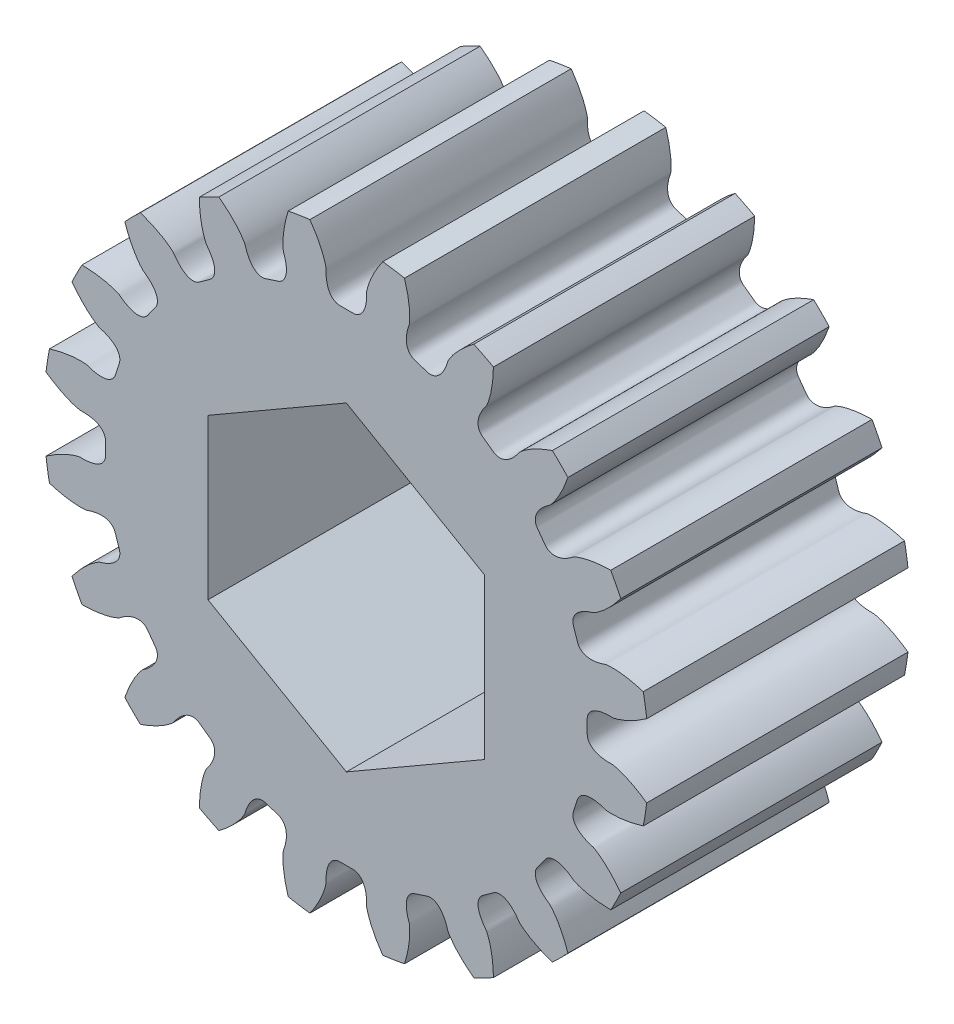
from build123d import *

# Parameters (mm, degrees)
BOSS_EXTRUDE1_DEPTH = 12.065
SKETCH2_R           = 8.89
BOSS_EXTRUDE2_DEPTH = 0.2921
BOSS_EXTRUDE3_START = 0.2921
SKETCH3_R           = 8.89
BOSS_EXTRUDE3_DEPTH = 0.2921
CUT_EXTRUDE1_DEPTH  = 24.338021171
SKETCH5_W           = 20.320535863
SKETCH5_H           = 0.371452269
CUT_EXTRUDE2_DEPTH  = 28.391102307


with BuildPart() as part:
    # Sketch1 → Boss-Extrude1 (new body)
    with BuildSketch(Plane(origin=(0, 0, -6.0325), x_dir=(-1, 0, 0), z_dir=(0, 0, -1))):
        with BuildLine():
            ThreePointArc((-9.512675365, 10.230831217), (-9.878281733, 9.878281733), (-10.230831217, 9.512675365))
            add(Edge.make_bspline(
                [(-12.208592606, 6.790520347), (-12.095329691, 6.789049814), (-11.929946947, 6.782686734), (-11.715987182, 6.765537407), (-11.569261116, 6.749788038), (-11.431876081, 6.731285472), (-11.303867458, 6.710521074), (-11.185250935, 6.687985966), (-11.076022333, 6.664170625), (-10.976158721, 6.639562645), (-10.88561498, 6.614651246), (-10.80433542, 6.589909593), (-10.732217032, 6.565848579), (-10.669225937, 6.542844439), (-10.615038746, 6.52166786), (-10.556574971, 6.495929693), (-10.491487475, 6.470161531), (-10.441415192, 6.424615713), (-10.398531232, 6.393943037), (-10.36439806, 6.369378589), (-10.330387779, 6.346004023), (-10.296648729, 6.323585507), (-10.263144513, 6.302173447), (-10.22988487, 6.281744386), (-10.196865285, 6.262294419), (-10.164082457, 6.243814996), (-10.131529962, 6.226299407), (-10.099199033, 6.20974131), (-10.067077965, 6.194135393), (-10.035151824, 6.179477546), (-10.003402014, 6.165765255), (-9.971805829, 6.152998041), (-9.940335941, 6.141178039), (-9.908959842, 6.130310714), (-9.877639252, 6.120405769), (-9.846329499, 6.111478297), (-9.814978912, 6.103550219), (-9.783528272, 6.09665211), (-9.751910419, 6.090825461), (-9.720050139, 6.086125512), (-9.687864549, 6.082624709), (-9.65526428, 6.080416885), (-9.622155894, 6.079622164), (-9.588446155, 6.080392488), (-9.55404892, 6.082917433), (-9.518895632, 6.087429592), (-9.482950389, 6.094208228), (-9.446230348, 6.103579075), (-9.408831405, 6.115907232), (-9.370957427, 6.131579299), (-9.332948442, 6.150971147), (-9.295300488, 6.174398879), (-9.258663835, 6.202057943), (-9.223818856, 6.233951347), (-9.193902709, 6.267277867), (-9.118313202, 6.36845856), (-9.004080784, 6.541847615), (-8.874477752, 6.704069266), (-8.801607637, 6.807225712), (-8.779156831, 6.84597612), (-8.759592091, 6.888971268), (-8.744608106, 6.932361917), (-8.733960867, 6.975406816), (-8.727263546, 7.017547919), (-8.724062227, 7.058411147), (-8.723894363, 7.097789266), (-8.726329274, 7.135607851), (-8.730990099, 7.171888523), (-8.737561744, 7.20671562), (-8.745789709, 7.240209585), (-8.75547397, 7.272507496), (-8.766460848, 7.303749859), (-8.778634651, 7.334072303), (-8.791910006, 7.36360081), (-8.806225291, 7.392449373), (-8.821537217, 7.420719205), (-8.837816492, 7.448498908), (-8.855044406, 7.475865178), (-8.873210182, 7.502883781), (-8.892308939, 7.529610636), (-8.912340127, 7.556092891), (-8.933306348, 7.582369952), (-8.955212448, 7.608474423), (-8.978064842, 7.634432956), (-9.001871003, 7.660266997), (-9.026639068, 7.685993454), (-9.052377561, 7.711625261), (-9.07909515, 7.73717191), (-9.106800577, 7.762639776), (-9.135502207, 7.788032897), (-9.165209194, 7.81335177), (-9.195926645, 7.838599483), (-9.227673861, 7.863759524), (-9.260414148, 7.888882085), (-9.294324057, 7.913753829), (-9.336747378, 7.945060521), (-9.395537212, 7.97860766), (-9.440157332, 8.032546746), (-9.482702084, 8.08019557), (-9.51958697, 8.125186728), (-9.560930527, 8.177986149), (-9.606099718, 8.23913955), (-9.654747193, 8.308795414), (-9.706418897, 8.387209583), (-9.76068203, 8.474581238), (-9.817085259, 8.571104467), (-9.875171942, 8.676951752), (-9.934476897, 8.792278635), (-9.994528194, 8.917221961), (-10.054847583, 9.05189992), (-10.137274765, 9.250088315), (-10.194432492, 9.405410351), (-10.230831217, 9.512675365)],
                knots=[0, 0, 0, 0, 0.047933382, 0.070007965, 0.090821144, 0.110372918, 0.128663287, 0.145692252, 0.161459812, 0.175965967, 0.189210717, 0.201194063, 0.211916004, 0.22137654, 0.229575672, 0.236513398, 0.248465852, 0.258824021, 0.264865189, 0.270795102, 0.276615554, 0.282328511, 0.287936135, 0.293440809, 0.29884516, 0.304152096, 0.30936484, 0.31448697, 0.319522469, 0.324475781, 0.329351871, 0.334156301, 0.33889531, 0.343575914, 0.348206011, 0.352794505, 0.357351445, 0.361888172, 0.366417487, 0.370953817, 0.375513382, 0.380114337, 0.384776871, 0.389523214, 0.394377492, 0.399365346, 0.404513199, 0.409847051, 0.415390659, 0.421163028, 0.427175267, 0.433427087, 0.439903549, 0.446572967, 0.453386989, 0.458818602, 0.5, 0.541181398, 0.546613011, 0.553427033, 0.560096451, 0.566572913, 0.572824733, 0.578836972, 0.584609341, 0.590152949, 0.595486801, 0.600634654, 0.605622508, 0.610476786, 0.615223129, 0.619885663, 0.624486618, 0.629046183, 0.633582513, 0.638111828, 0.642648555, 0.647205495, 0.651793989, 0.656424086, 0.66110469, 0.665843699, 0.670648129, 0.675524219, 0.680477531, 0.68551303, 0.69063516, 0.695847904, 0.70115484, 0.706559191, 0.712063865, 0.717671489, 0.723384446, 0.729204898, 0.735134811, 0.741175979, 0.751534148, 0.763486602, 0.770424328, 0.77862346, 0.788083996, 0.798805937, 0.810789283, 0.824034033, 0.838540188, 0.854307748, 0.871336713, 0.889627082, 0.909178856, 0.929992035, 0.952066618, 1, 1, 1, 1], degree=3))
            ThreePointArc((-12.208592606, 6.790520347), (-12.447361143, 6.342247281), (-12.669677046, 5.88559118))
            add(Edge.make_bspline(
                [(-13.709447741, 2.685506032), (-13.601273887, 2.719107638), (-13.442019252, 2.764162068), (-13.233231989, 2.813969292), (-13.088820385, 2.844331599), (-12.952441845, 2.869188924), (-12.824281858, 2.888997649), (-12.70450711, 2.904220008), (-12.593265191, 2.915323768), (-12.490684968, 2.922779741), (-12.396874707, 2.927067147), (-12.311927661, 2.928653202), (-12.235903736, 2.928055626), (-12.168886974, 2.925642708), (-12.110807971, 2.922247347), (-12.047252085, 2.915835196), (-11.977387399, 2.911441359), (-11.915691396, 2.883597899), (-11.865427948, 2.867678323), (-11.82537454, 2.854863874), (-11.785805703, 2.843143096), (-11.746790257, 2.83224776), (-11.708309163, 2.822237054), (-11.670364436, 2.813085657), (-11.632950574, 2.804791252), (-11.596061797, 2.797346727), (-11.559689919, 2.790747687), (-11.523824645, 2.784990807), (-11.488453201, 2.780074653), (-11.453560112, 2.775999933), (-11.419126917, 2.77277), (-11.385131874, 2.770391416), (-11.35154965, 2.768874656), (-11.318351018, 2.768234964), (-11.285502571, 2.768493396), (-11.252966486, 2.769678111), (-11.220700396, 2.771825925), (-11.188657426, 2.774984215), (-11.156786527, 2.779213197), (-11.125033236, 2.784588648), (-11.093341114, 2.791205081), (-11.06165416, 2.799179353), (-11.029920632, 2.808654582), (-10.998098808, 2.819804086), (-10.966165345, 2.832834781), (-10.934126915, 2.847989063), (-10.902035671, 2.86554362), (-10.870008588, 2.885802942), (-10.838249689, 2.909084625), (-10.807072331, 2.935693349), (-10.776916049, 2.965881515), (-10.748350284, 2.999796469), (-10.722053877, 3.037423151), (-10.698769937, 3.078523271), (-10.680616451, 3.119463274), (-10.639993112, 3.239050273), (-10.584931791, 3.439252822), (-10.511801229, 3.63358432), (-10.474374727, 3.754210034), (-10.464997275, 3.798001542), (-10.459676334, 3.844938195), (-10.458834165, 3.89083546), (-10.462009645, 3.93506377), (-10.46866243, 3.977211927), (-10.478245228, 4.017064428), (-10.490254087, 4.054567118), (-10.504256411, 4.0897823), (-10.519900463, 4.122846996), (-10.536912634, 4.153938783), (-10.555088098, 4.183250856), (-10.57427898, 4.210975393), (-10.594382544, 4.237293514), (-10.615330668, 4.26236996), (-10.637081092, 4.286350929), (-10.659610434, 4.309363876), (-10.682908799, 4.331518439), (-10.70697571, 4.352907934), (-10.731817072, 4.373611085), (-10.757442959, 4.39369377), (-10.783866009, 4.413210679), (-10.811100268, 4.432206823), (-10.839160387, 4.450718874), (-10.868061051, 4.468776345), (-10.897816598, 4.486402598), (-10.92844076, 4.503615723), (-10.959946502, 4.520429284), (-10.992345927, 4.53685295), (-11.025650213, 4.552893067), (-11.059869643, 4.568553), (-11.095013422, 4.583834001), (-11.131090407, 4.598733717), (-11.168106411, 4.613253505), (-11.206074688, 4.627371696), (-11.24497585, 4.641147366), (-11.284911882, 4.654323063), (-11.334933157, 4.670987968), (-11.401212248, 4.684726136), (-11.460316599, 4.72223688), (-11.515503358, 4.754406553), (-11.564486002, 4.78579763), (-11.620121979, 4.823237002), (-11.681977873, 4.867439295), (-11.749769217, 4.918653062), (-11.823143238, 4.977261934), (-11.901749871, 5.043589085), (-11.985219847, 5.117958575), (-12.073172176, 5.200675553), (-12.165212507, 5.292031698), (-12.260934295, 5.392302991), (-12.35991922, 5.501749624), (-12.499555712, 5.664766589), (-12.601913089, 5.794823915), (-12.669677046, 5.88559118)],
                knots=[0, 0, 0, 0, 0.047933382, 0.070007965, 0.090821144, 0.110372918, 0.128663287, 0.145692252, 0.161459812, 0.175965967, 0.189210717, 0.201194063, 0.211916004, 0.22137654, 0.229575672, 0.236513398, 0.248465852, 0.258824021, 0.264865189, 0.270795102, 0.276615554, 0.282328511, 0.287936135, 0.293440809, 0.29884516, 0.304152096, 0.30936484, 0.31448697, 0.319522469, 0.324475781, 0.329351871, 0.334156301, 0.33889531, 0.343575914, 0.348206011, 0.352794505, 0.357351445, 0.361888172, 0.366417487, 0.370953817, 0.375513382, 0.380114337, 0.384776871, 0.389523214, 0.394377492, 0.399365346, 0.404513199, 0.409847051, 0.415390659, 0.421163028, 0.427175267, 0.433427087, 0.439903549, 0.446572967, 0.453386989, 0.458818602, 0.5, 0.541181398, 0.546613011, 0.553427033, 0.560096451, 0.566572913, 0.572824733, 0.578836972, 0.584609341, 0.590152949, 0.595486801, 0.600634654, 0.605622508, 0.610476786, 0.615223129, 0.619885663, 0.624486618, 0.629046183, 0.633582513, 0.638111828, 0.642648555, 0.647205495, 0.651793989, 0.656424086, 0.66110469, 0.665843699, 0.670648129, 0.675524219, 0.680477531, 0.68551303, 0.69063516, 0.695847904, 0.70115484, 0.706559191, 0.712063865, 0.717671489, 0.723384446, 0.729204898, 0.735134811, 0.741175979, 0.751534148, 0.763486602, 0.770424328, 0.77862346, 0.788083996, 0.798805937, 0.810789283, 0.824034033, 0.838540188, 0.854307748, 0.871336713, 0.889627082, 0.909178856, 0.929992035, 0.952066618, 1, 1, 1, 1], degree=3))
            ThreePointArc((-13.709447741, 2.685506032), (-13.798006118, 2.185389477), (-13.868326611, 1.682384324))
            add(Edge.make_bspline(
                [(-13.868326611, -1.682384324), (-13.77583063, -1.616999739), (-13.638293056, -1.524938041), (-13.455115848, -1.413049743), (-13.32715472, -1.339547833), (-13.205132356, -1.273763826), (-13.089366198, -1.215320995), (-12.980157611, -1.163831239), (-12.87779151, -1.118895292), (-12.782535943, -1.080105208), (-12.694641964, -1.047038678), (-12.61434264, -1.019280169), (-12.54185493, -0.996355812), (-12.477372569, -0.977941316), (-12.42108693, -0.963223097), (-12.358660227, -0.949681567), (-12.290857192, -0.932270978), (-12.223576704, -0.939686569), (-12.170853905, -0.939294726), (-12.128800968, -0.939104807), (-12.087546848, -0.938024486), (-12.047074109, -0.936330131), (-12.007382936, -0.933959566), (-11.968467419, -0.930937496), (-11.93032161, -0.927264425), (-11.892937813, -0.92294533), (-11.856306886, -0.917981862), (-11.82041801, -0.912374001), (-11.785258592, -0.906119163), (-11.750814135, -0.899211895), (-11.717068117, -0.891643302), (-11.684001886, -0.883400423), (-11.651594589, -0.87446547), (-11.619823138, -0.864814912), (-11.588662268, -0.8544184), (-11.55808471, -0.843237466), (-11.528061545, -0.831224003), (-11.498562836, -0.818318468), (-11.469558637, -0.804447818), (-11.441020568, -0.789523154), (-11.412924159, -0.773437148), (-11.38525226, -0.756061357), (-11.357999889, -0.73724368), (-11.331180922, -0.716806387), (-11.304837099, -0.694545476), (-11.279049673, -0.670232479), (-11.253953742, -0.643620363), (-11.229754651, -0.61445569), (-11.206744579, -0.582499454), (-11.185315697, -0.547558721), (-11.165964025, -0.509529265), (-11.149276665, -0.46844692), (-11.13589458, -0.424535782), (-11.126450873, -0.378252112), (-11.121837039, -0.33370612), (-11.120156362, -0.207418823), (-11.129655924, 0), (-11.120156362, 0.207418823), (-11.121837039, 0.33370612), (-11.126450873, 0.378252112), (-11.13589458, 0.424535782), (-11.149276665, 0.46844692), (-11.165964025, 0.509529265), (-11.185315697, 0.547558721), (-11.206744579, 0.582499454), (-11.229754651, 0.61445569), (-11.253953742, 0.643620363), (-11.279049673, 0.670232479), (-11.304837099, 0.694545476), (-11.331180922, 0.716806387), (-11.357999889, 0.73724368), (-11.38525226, 0.756061357), (-11.412924159, 0.773437148), (-11.441020568, 0.789523154), (-11.469558637, 0.804447818), (-11.498562836, 0.818318468), (-11.528061545, 0.831224003), (-11.55808471, 0.843237466), (-11.588662268, 0.8544184), (-11.619823138, 0.864814912), (-11.651594589, 0.87446547), (-11.684001886, 0.883400423), (-11.717068117, 0.891643302), (-11.750814135, 0.899211895), (-11.785258592, 0.906119163), (-11.82041801, 0.912374001), (-11.856306886, 0.917981862), (-11.892937813, 0.92294533), (-11.93032161, 0.927264425), (-11.968467419, 0.930937496), (-12.007382936, 0.933959566), (-12.047074109, 0.936330131), (-12.087546848, 0.938024486), (-12.128800968, 0.939104807), (-12.170853905, 0.939294726), (-12.223576704, 0.939686569), (-12.290857192, 0.932270978), (-12.358660227, 0.949681567), (-12.42108693, 0.963223097), (-12.477372569, 0.977941316), (-12.54185493, 0.996355812), (-12.61434264, 1.019280169), (-12.694641964, 1.047038678), (-12.782535943, 1.080105208), (-12.87779151, 1.118895292), (-12.980157611, 1.163831239), (-13.089366198, 1.215320995), (-13.205132356, 1.273763826), (-13.32715472, 1.339547833), (-13.455115848, 1.413049743), (-13.638293056, 1.524938041), (-13.77583063, 1.616999739), (-13.868326611, 1.682384324)],
                knots=[0, 0, 0, 0, 0.047933382, 0.070007965, 0.090821144, 0.110372918, 0.128663287, 0.145692252, 0.161459812, 0.175965967, 0.189210717, 0.201194063, 0.211916004, 0.22137654, 0.229575672, 0.236513398, 0.248465852, 0.258824021, 0.264865189, 0.270795102, 0.276615554, 0.282328511, 0.287936135, 0.293440809, 0.29884516, 0.304152096, 0.30936484, 0.31448697, 0.319522469, 0.324475781, 0.329351871, 0.334156301, 0.33889531, 0.343575914, 0.348206011, 0.352794505, 0.357351445, 0.361888172, 0.366417487, 0.370953817, 0.375513382, 0.380114337, 0.384776871, 0.389523214, 0.394377492, 0.399365346, 0.404513199, 0.409847051, 0.415390659, 0.421163028, 0.427175267, 0.433427087, 0.439903549, 0.446572967, 0.453386989, 0.458818602, 0.5, 0.541181398, 0.546613011, 0.553427033, 0.560096451, 0.566572913, 0.572824733, 0.578836972, 0.584609341, 0.590152949, 0.595486801, 0.600634654, 0.605622508, 0.610476786, 0.615223129, 0.619885663, 0.624486618, 0.629046183, 0.633582513, 0.638111828, 0.642648555, 0.647205495, 0.651793989, 0.656424086, 0.66110469, 0.665843699, 0.670648129, 0.675524219, 0.680477531, 0.68551303, 0.69063516, 0.695847904, 0.70115484, 0.706559191, 0.712063865, 0.717671489, 0.723384446, 0.729204898, 0.735134811, 0.741175979, 0.751534148, 0.763486602, 0.770424328, 0.77862346, 0.788083996, 0.798805937, 0.810789283, 0.824034033, 0.838540188, 0.854307748, 0.871336713, 0.889627082, 0.909178856, 0.929992035, 0.952066618, 1, 1, 1, 1], degree=3))
            ThreePointArc((-13.868326611, -1.682384324), (-13.798006118, -2.185389477), (-13.709447741, -2.685506032))
            add(Edge.make_bspline(
                [(-12.669677046, -5.88559118), (-12.601913089, -5.794823915), (-12.499555712, -5.664766589), (-12.35991922, -5.501749624), (-12.260934295, -5.392302991), (-12.165212507, -5.292031698), (-12.073172176, -5.200675553), (-11.985219847, -5.117958575), (-11.901749871, -5.043589085), (-11.823143238, -4.977261934), (-11.749769217, -4.918653062), (-11.681977873, -4.867439295), (-11.620121979, -4.823237002), (-11.564486002, -4.78579763), (-11.515503358, -4.754406553), (-11.460316599, -4.72223688), (-11.401212248, -4.684726136), (-11.334933157, -4.670987968), (-11.284911882, -4.654323063), (-11.24497585, -4.641147366), (-11.206074688, -4.627371696), (-11.168106411, -4.613253505), (-11.131090407, -4.598733717), (-11.095013422, -4.583834001), (-11.059869643, -4.568553), (-11.025650213, -4.552893067), (-10.992345927, -4.53685295), (-10.959946502, -4.520429284), (-10.92844076, -4.503615723), (-10.897816598, -4.486402598), (-10.868061051, -4.468776345), (-10.839160387, -4.450718874), (-10.811100268, -4.432206823), (-10.783866009, -4.413210679), (-10.757442959, -4.39369377), (-10.731817072, -4.373611085), (-10.70697571, -4.352907934), (-10.682908799, -4.331518439), (-10.659610434, -4.309363876), (-10.637081092, -4.286350929), (-10.615330668, -4.26236996), (-10.594382544, -4.237293514), (-10.57427898, -4.210975393), (-10.555088098, -4.183250856), (-10.536912634, -4.153938783), (-10.519900463, -4.122846996), (-10.504256411, -4.0897823), (-10.490254087, -4.054567118), (-10.478245228, -4.017064428), (-10.46866243, -3.977211927), (-10.462009645, -3.93506377), (-10.458834165, -3.89083546), (-10.459676334, -3.844938195), (-10.464997275, -3.798001542), (-10.474374727, -3.754210034), (-10.511801229, -3.63358432), (-10.584931791, -3.439252822), (-10.639993112, -3.239050273), (-10.680616451, -3.119463274), (-10.698769937, -3.078523271), (-10.722053877, -3.037423151), (-10.748350284, -2.999796469), (-10.776916049, -2.965881515), (-10.807072331, -2.935693349), (-10.838249689, -2.909084625), (-10.870008588, -2.885802942), (-10.902035671, -2.86554362), (-10.934126915, -2.847989063), (-10.966165345, -2.832834781), (-10.998098808, -2.819804086), (-11.029920632, -2.808654582), (-11.06165416, -2.799179353), (-11.093341114, -2.791205081), (-11.125033236, -2.784588648), (-11.156786527, -2.779213197), (-11.188657426, -2.774984215), (-11.220700396, -2.771825925), (-11.252966486, -2.769678111), (-11.285502571, -2.768493396), (-11.318351018, -2.768234964), (-11.35154965, -2.768874656), (-11.385131874, -2.770391416), (-11.419126917, -2.77277), (-11.453560112, -2.775999933), (-11.488453201, -2.780074653), (-11.523824645, -2.784990807), (-11.559689919, -2.790747687), (-11.596061797, -2.797346727), (-11.632950574, -2.804791252), (-11.670364436, -2.813085657), (-11.708309163, -2.822237054), (-11.746790257, -2.83224776), (-11.785805703, -2.843143096), (-11.82537454, -2.854863874), (-11.865427948, -2.867678323), (-11.915691396, -2.883597899), (-11.977387399, -2.911441359), (-12.047252085, -2.915835196), (-12.110807971, -2.922247347), (-12.168886974, -2.925642708), (-12.235903736, -2.928055626), (-12.311927661, -2.928653202), (-12.396874707, -2.927067147), (-12.490684968, -2.922779741), (-12.593265191, -2.915323768), (-12.70450711, -2.904220008), (-12.824281858, -2.888997649), (-12.952441845, -2.869188924), (-13.088820385, -2.844331599), (-13.233231989, -2.813969292), (-13.442019252, -2.764162068), (-13.601273887, -2.719107638), (-13.709447741, -2.685506032)],
                knots=[0, 0, 0, 0, 0.047933382, 0.070007965, 0.090821144, 0.110372918, 0.128663287, 0.145692252, 0.161459812, 0.175965967, 0.189210717, 0.201194063, 0.211916004, 0.22137654, 0.229575672, 0.236513398, 0.248465852, 0.258824021, 0.264865189, 0.270795102, 0.276615554, 0.282328511, 0.287936135, 0.293440809, 0.29884516, 0.304152096, 0.30936484, 0.31448697, 0.319522469, 0.324475781, 0.329351871, 0.334156301, 0.33889531, 0.343575914, 0.348206011, 0.352794505, 0.357351445, 0.361888172, 0.366417487, 0.370953817, 0.375513382, 0.380114337, 0.384776871, 0.389523214, 0.394377492, 0.399365346, 0.404513199, 0.409847051, 0.415390659, 0.421163028, 0.427175267, 0.433427087, 0.439903549, 0.446572967, 0.453386989, 0.458818602, 0.5, 0.541181398, 0.546613011, 0.553427033, 0.560096451, 0.566572913, 0.572824733, 0.578836972, 0.584609341, 0.590152949, 0.595486801, 0.600634654, 0.605622508, 0.610476786, 0.615223129, 0.619885663, 0.624486618, 0.629046183, 0.633582513, 0.638111828, 0.642648555, 0.647205495, 0.651793989, 0.656424086, 0.66110469, 0.665843699, 0.670648129, 0.675524219, 0.680477531, 0.68551303, 0.69063516, 0.695847904, 0.70115484, 0.706559191, 0.712063865, 0.717671489, 0.723384446, 0.729204898, 0.735134811, 0.741175979, 0.751534148, 0.763486602, 0.770424328, 0.77862346, 0.788083996, 0.798805937, 0.810789283, 0.824034033, 0.838540188, 0.854307748, 0.871336713, 0.889627082, 0.909178856, 0.929992035, 0.952066618, 1, 1, 1, 1], degree=3))
            ThreePointArc((-12.669677046, -5.88559118), (-12.447361143, -6.342247281), (-12.208592606, -6.790520347))
            add(Edge.make_bspline(
                [(-10.230831217, -9.512675365), (-10.194432492, -9.405410351), (-10.137274765, -9.250088315), (-10.054847583, -9.05189992), (-9.994528194, -8.917221961), (-9.934476897, -8.792278635), (-9.875171942, -8.676951752), (-9.817085259, -8.571104467), (-9.76068203, -8.474581238), (-9.706418897, -8.387209583), (-9.654747193, -8.308795414), (-9.606099718, -8.23913955), (-9.560930527, -8.177986149), (-9.51958697, -8.125186728), (-9.482702084, -8.08019557), (-9.440157332, -8.032546746), (-9.395537212, -7.97860766), (-9.336747378, -7.945060521), (-9.294324057, -7.913753829), (-9.260414148, -7.888882085), (-9.227673861, -7.863759524), (-9.195926645, -7.838599483), (-9.165209194, -7.81335177), (-9.135502207, -7.788032897), (-9.106800577, -7.762639776), (-9.07909515, -7.73717191), (-9.052377561, -7.711625261), (-9.026639068, -7.685993454), (-9.001871003, -7.660266997), (-8.978064842, -7.634432956), (-8.955212448, -7.608474423), (-8.933306348, -7.582369952), (-8.912340127, -7.556092891), (-8.892308939, -7.529610636), (-8.873210182, -7.502883781), (-8.855044406, -7.475865178), (-8.837816492, -7.448498908), (-8.821537217, -7.420719205), (-8.806225291, -7.392449373), (-8.791910006, -7.36360081), (-8.778634651, -7.334072303), (-8.766460848, -7.303749859), (-8.75547397, -7.272507496), (-8.745789709, -7.240209585), (-8.737561744, -7.20671562), (-8.730990099, -7.171888523), (-8.726329274, -7.135607851), (-8.723894363, -7.097789266), (-8.724062227, -7.058411147), (-8.727263546, -7.017547919), (-8.733960867, -6.975406816), (-8.744608106, -6.932361917), (-8.759592091, -6.888971268), (-8.779156831, -6.84597612), (-8.801607637, -6.807225712), (-8.874477752, -6.704069266), (-9.004080784, -6.541847615), (-9.118313202, -6.36845856), (-9.193902709, -6.267277867), (-9.223818856, -6.233951347), (-9.258663835, -6.202057943), (-9.295300488, -6.174398879), (-9.332948442, -6.150971147), (-9.370957427, -6.131579299), (-9.408831405, -6.115907232), (-9.446230348, -6.103579075), (-9.482950389, -6.094208228), (-9.518895632, -6.087429592), (-9.55404892, -6.082917433), (-9.588446155, -6.080392488), (-9.622155894, -6.079622164), (-9.65526428, -6.080416885), (-9.687864549, -6.082624709), (-9.720050139, -6.086125512), (-9.751910419, -6.090825461), (-9.783528272, -6.09665211), (-9.814978912, -6.103550219), (-9.846329499, -6.111478297), (-9.877639252, -6.120405769), (-9.908959842, -6.130310714), (-9.940335941, -6.141178039), (-9.971805829, -6.152998041), (-10.003402014, -6.165765255), (-10.035151824, -6.179477546), (-10.067077965, -6.194135393), (-10.099199033, -6.20974131), (-10.131529962, -6.226299407), (-10.164082457, -6.243814996), (-10.196865285, -6.262294419), (-10.22988487, -6.281744386), (-10.263144513, -6.302173447), (-10.296648729, -6.323585507), (-10.330387779, -6.346004023), (-10.36439806, -6.369378589), (-10.398531232, -6.393943037), (-10.441415192, -6.424615713), (-10.491487475, -6.470161531), (-10.556574971, -6.495929693), (-10.615038746, -6.52166786), (-10.669225937, -6.542844439), (-10.732217032, -6.565848579), (-10.80433542, -6.589909593), (-10.88561498, -6.614651246), (-10.976158721, -6.639562645), (-11.076022333, -6.664170625), (-11.185250935, -6.687985966), (-11.303867458, -6.710521074), (-11.431876081, -6.731285472), (-11.569261116, -6.749788038), (-11.715987182, -6.765537407), (-11.929946947, -6.782686734), (-12.095329691, -6.789049814), (-12.208592606, -6.790520347)],
                knots=[0, 0, 0, 0, 0.047933382, 0.070007965, 0.090821144, 0.110372918, 0.128663287, 0.145692252, 0.161459812, 0.175965967, 0.189210717, 0.201194063, 0.211916004, 0.22137654, 0.229575672, 0.236513398, 0.248465852, 0.258824021, 0.264865189, 0.270795102, 0.276615554, 0.282328511, 0.287936135, 0.293440809, 0.29884516, 0.304152096, 0.30936484, 0.31448697, 0.319522469, 0.324475781, 0.329351871, 0.334156301, 0.33889531, 0.343575914, 0.348206011, 0.352794505, 0.357351445, 0.361888172, 0.366417487, 0.370953817, 0.375513382, 0.380114337, 0.384776871, 0.389523214, 0.394377492, 0.399365346, 0.404513199, 0.409847051, 0.415390659, 0.421163028, 0.427175267, 0.433427087, 0.439903549, 0.446572967, 0.453386989, 0.458818602, 0.5, 0.541181398, 0.546613011, 0.553427033, 0.560096451, 0.566572913, 0.572824733, 0.578836972, 0.584609341, 0.590152949, 0.595486801, 0.600634654, 0.605622508, 0.610476786, 0.615223129, 0.619885663, 0.624486618, 0.629046183, 0.633582513, 0.638111828, 0.642648555, 0.647205495, 0.651793989, 0.656424086, 0.66110469, 0.665843699, 0.670648129, 0.675524219, 0.680477531, 0.68551303, 0.69063516, 0.695847904, 0.70115484, 0.706559191, 0.712063865, 0.717671489, 0.723384446, 0.729204898, 0.735134811, 0.741175979, 0.751534148, 0.763486602, 0.770424328, 0.77862346, 0.788083996, 0.798805937, 0.810789283, 0.824034033, 0.838540188, 0.854307748, 0.871336713, 0.889627082, 0.909178856, 0.929992035, 0.952066618, 1, 1, 1, 1], degree=3))
            ThreePointArc((-10.230831217, -9.512675365), (-9.878281733, -9.878281733), (-9.512675365, -10.230831217))
            add(Edge.make_bspline(
                [(-6.790520347, -12.208592606), (-6.789049814, -12.095329691), (-6.782686734, -11.929946947), (-6.765537407, -11.715987182), (-6.749788038, -11.569261116), (-6.731285472, -11.431876081), (-6.710521074, -11.303867458), (-6.687985966, -11.185250935), (-6.664170625, -11.076022333), (-6.639562645, -10.976158721), (-6.614651246, -10.88561498), (-6.589909593, -10.80433542), (-6.565848579, -10.732217032), (-6.542844439, -10.669225937), (-6.52166786, -10.615038746), (-6.495929693, -10.556574971), (-6.470161531, -10.491487475), (-6.424615713, -10.441415192), (-6.393943037, -10.398531232), (-6.369378589, -10.36439806), (-6.346004023, -10.330387779), (-6.323585507, -10.296648729), (-6.302173447, -10.263144513), (-6.281744386, -10.22988487), (-6.262294419, -10.196865285), (-6.243814996, -10.164082457), (-6.226299407, -10.131529962), (-6.20974131, -10.099199033), (-6.194135393, -10.067077965), (-6.179477546, -10.035151824), (-6.165765255, -10.003402014), (-6.152998041, -9.971805829), (-6.141178039, -9.940335941), (-6.130310714, -9.908959842), (-6.120405769, -9.877639252), (-6.111478297, -9.846329499), (-6.103550219, -9.814978912), (-6.09665211, -9.783528272), (-6.090825461, -9.751910419), (-6.086125512, -9.720050139), (-6.082624709, -9.687864549), (-6.080416885, -9.65526428), (-6.079622164, -9.622155894), (-6.080392488, -9.588446155), (-6.082917433, -9.55404892), (-6.087429592, -9.518895632), (-6.094208228, -9.482950389), (-6.103579075, -9.446230348), (-6.115907232, -9.408831405), (-6.131579299, -9.370957427), (-6.150971147, -9.332948442), (-6.174398879, -9.295300488), (-6.202057943, -9.258663835), (-6.233951347, -9.223818856), (-6.267277867, -9.193902709), (-6.36845856, -9.118313202), (-6.541847615, -9.004080784), (-6.704069266, -8.874477752), (-6.807225712, -8.801607637), (-6.84597612, -8.779156831), (-6.888971268, -8.759592091), (-6.932361917, -8.744608106), (-6.975406816, -8.733960867), (-7.017547919, -8.727263546), (-7.058411147, -8.724062227), (-7.097789266, -8.723894363), (-7.135607851, -8.726329274), (-7.171888523, -8.730990099), (-7.20671562, -8.737561744), (-7.240209585, -8.745789709), (-7.272507496, -8.75547397), (-7.303749859, -8.766460848), (-7.334072303, -8.778634651), (-7.36360081, -8.791910006), (-7.392449373, -8.806225291), (-7.420719205, -8.821537217), (-7.448498908, -8.837816492), (-7.475865178, -8.855044406), (-7.502883781, -8.873210182), (-7.529610636, -8.892308939), (-7.556092891, -8.912340127), (-7.582369952, -8.933306348), (-7.608474423, -8.955212448), (-7.634432956, -8.978064842), (-7.660266997, -9.001871003), (-7.685993454, -9.026639068), (-7.711625261, -9.052377561), (-7.73717191, -9.07909515), (-7.762639776, -9.106800577), (-7.788032897, -9.135502207), (-7.81335177, -9.165209194), (-7.838599483, -9.195926645), (-7.863759524, -9.227673861), (-7.888882085, -9.260414148), (-7.913753829, -9.294324057), (-7.945060521, -9.336747378), (-7.97860766, -9.395537212), (-8.032546746, -9.440157332), (-8.08019557, -9.482702084), (-8.125186728, -9.51958697), (-8.177986149, -9.560930527), (-8.23913955, -9.606099718), (-8.308795414, -9.654747193), (-8.387209583, -9.706418897), (-8.474581238, -9.76068203), (-8.571104467, -9.817085259), (-8.676951752, -9.875171942), (-8.792278635, -9.934476897), (-8.917221961, -9.994528194), (-9.05189992, -10.054847583), (-9.250088315, -10.137274765), (-9.405410351, -10.194432492), (-9.512675365, -10.230831217)],
                knots=[0, 0, 0, 0, 0.047933382, 0.070007965, 0.090821144, 0.110372918, 0.128663287, 0.145692252, 0.161459812, 0.175965967, 0.189210717, 0.201194063, 0.211916004, 0.22137654, 0.229575672, 0.236513398, 0.248465852, 0.258824021, 0.264865189, 0.270795102, 0.276615554, 0.282328511, 0.287936135, 0.293440809, 0.29884516, 0.304152096, 0.30936484, 0.31448697, 0.319522469, 0.324475781, 0.329351871, 0.334156301, 0.33889531, 0.343575914, 0.348206011, 0.352794505, 0.357351445, 0.361888172, 0.366417487, 0.370953817, 0.375513382, 0.380114337, 0.384776871, 0.389523214, 0.394377492, 0.399365346, 0.404513199, 0.409847051, 0.415390659, 0.421163028, 0.427175267, 0.433427087, 0.439903549, 0.446572967, 0.453386989, 0.458818602, 0.5, 0.541181398, 0.546613011, 0.553427033, 0.560096451, 0.566572913, 0.572824733, 0.578836972, 0.584609341, 0.590152949, 0.595486801, 0.600634654, 0.605622508, 0.610476786, 0.615223129, 0.619885663, 0.624486618, 0.629046183, 0.633582513, 0.638111828, 0.642648555, 0.647205495, 0.651793989, 0.656424086, 0.66110469, 0.665843699, 0.670648129, 0.675524219, 0.680477531, 0.68551303, 0.69063516, 0.695847904, 0.70115484, 0.706559191, 0.712063865, 0.717671489, 0.723384446, 0.729204898, 0.735134811, 0.741175979, 0.751534148, 0.763486602, 0.770424328, 0.77862346, 0.788083996, 0.798805937, 0.810789283, 0.824034033, 0.838540188, 0.854307748, 0.871336713, 0.889627082, 0.909178856, 0.929992035, 0.952066618, 1, 1, 1, 1], degree=3))
            ThreePointArc((-6.790520347, -12.208592606), (-6.342247281, -12.447361143), (-5.88559118, -12.669677046))
            add(Edge.make_bspline(
                [(-2.685506032, -13.709447741), (-2.719107638, -13.601273887), (-2.764162068, -13.442019252), (-2.813969292, -13.233231989), (-2.844331599, -13.088820385), (-2.869188924, -12.952441845), (-2.888997649, -12.824281858), (-2.904220008, -12.70450711), (-2.915323768, -12.593265191), (-2.922779741, -12.490684968), (-2.927067147, -12.396874707), (-2.928653202, -12.311927661), (-2.928055626, -12.235903736), (-2.925642708, -12.168886974), (-2.922247347, -12.110807971), (-2.915835196, -12.047252085), (-2.911441359, -11.977387399), (-2.883597899, -11.915691396), (-2.867678323, -11.865427948), (-2.854863874, -11.82537454), (-2.843143096, -11.785805703), (-2.83224776, -11.746790257), (-2.822237054, -11.708309163), (-2.813085657, -11.670364436), (-2.804791252, -11.632950574), (-2.797346727, -11.596061797), (-2.790747687, -11.559689919), (-2.784990807, -11.523824645), (-2.780074653, -11.488453201), (-2.775999933, -11.453560112), (-2.77277, -11.419126917), (-2.770391416, -11.385131874), (-2.768874656, -11.35154965), (-2.768234964, -11.318351018), (-2.768493396, -11.285502571), (-2.769678111, -11.252966486), (-2.771825925, -11.220700396), (-2.774984215, -11.188657426), (-2.779213197, -11.156786527), (-2.784588648, -11.125033236), (-2.791205081, -11.093341114), (-2.799179353, -11.06165416), (-2.808654582, -11.029920632), (-2.819804086, -10.998098808), (-2.832834781, -10.966165345), (-2.847989063, -10.934126915), (-2.86554362, -10.902035671), (-2.885802942, -10.870008588), (-2.909084625, -10.838249689), (-2.935693349, -10.807072331), (-2.965881515, -10.776916049), (-2.999796469, -10.748350284), (-3.037423151, -10.722053877), (-3.078523271, -10.698769937), (-3.119463274, -10.680616451), (-3.239050273, -10.639993112), (-3.439252822, -10.584931791), (-3.63358432, -10.511801229), (-3.754210034, -10.474374727), (-3.798001542, -10.464997275), (-3.844938195, -10.459676334), (-3.89083546, -10.458834165), (-3.93506377, -10.462009645), (-3.977211927, -10.46866243), (-4.017064428, -10.478245228), (-4.054567118, -10.490254087), (-4.0897823, -10.504256411), (-4.122846996, -10.519900463), (-4.153938783, -10.536912634), (-4.183250856, -10.555088098), (-4.210975393, -10.57427898), (-4.237293514, -10.594382544), (-4.26236996, -10.615330668), (-4.286350929, -10.637081092), (-4.309363876, -10.659610434), (-4.331518439, -10.682908799), (-4.352907934, -10.70697571), (-4.373611085, -10.731817072), (-4.39369377, -10.757442959), (-4.413210679, -10.783866009), (-4.432206823, -10.811100268), (-4.450718874, -10.839160387), (-4.468776345, -10.868061051), (-4.486402598, -10.897816598), (-4.503615723, -10.92844076), (-4.520429284, -10.959946502), (-4.53685295, -10.992345927), (-4.552893067, -11.025650213), (-4.568553, -11.059869643), (-4.583834001, -11.095013422), (-4.598733717, -11.131090407), (-4.613253505, -11.168106411), (-4.627371696, -11.206074688), (-4.641147366, -11.24497585), (-4.654323063, -11.284911882), (-4.670987968, -11.334933157), (-4.684726136, -11.401212248), (-4.72223688, -11.460316599), (-4.754406553, -11.515503358), (-4.78579763, -11.564486002), (-4.823237002, -11.620121979), (-4.867439295, -11.681977873), (-4.918653062, -11.749769217), (-4.977261934, -11.823143238), (-5.043589085, -11.901749871), (-5.117958575, -11.985219847), (-5.200675553, -12.073172176), (-5.292031698, -12.165212507), (-5.392302991, -12.260934295), (-5.501749624, -12.35991922), (-5.664766589, -12.499555712), (-5.794823915, -12.601913089), (-5.88559118, -12.669677046)],
                knots=[0, 0, 0, 0, 0.047933382, 0.070007965, 0.090821144, 0.110372918, 0.128663287, 0.145692252, 0.161459812, 0.175965967, 0.189210717, 0.201194063, 0.211916004, 0.22137654, 0.229575672, 0.236513398, 0.248465852, 0.258824021, 0.264865189, 0.270795102, 0.276615554, 0.282328511, 0.287936135, 0.293440809, 0.29884516, 0.304152096, 0.30936484, 0.31448697, 0.319522469, 0.324475781, 0.329351871, 0.334156301, 0.33889531, 0.343575914, 0.348206011, 0.352794505, 0.357351445, 0.361888172, 0.366417487, 0.370953817, 0.375513382, 0.380114337, 0.384776871, 0.389523214, 0.394377492, 0.399365346, 0.404513199, 0.409847051, 0.415390659, 0.421163028, 0.427175267, 0.433427087, 0.439903549, 0.446572967, 0.453386989, 0.458818602, 0.5, 0.541181398, 0.546613011, 0.553427033, 0.560096451, 0.566572913, 0.572824733, 0.578836972, 0.584609341, 0.590152949, 0.595486801, 0.600634654, 0.605622508, 0.610476786, 0.615223129, 0.619885663, 0.624486618, 0.629046183, 0.633582513, 0.638111828, 0.642648555, 0.647205495, 0.651793989, 0.656424086, 0.66110469, 0.665843699, 0.670648129, 0.675524219, 0.680477531, 0.68551303, 0.69063516, 0.695847904, 0.70115484, 0.706559191, 0.712063865, 0.717671489, 0.723384446, 0.729204898, 0.735134811, 0.741175979, 0.751534148, 0.763486602, 0.770424328, 0.77862346, 0.788083996, 0.798805937, 0.810789283, 0.824034033, 0.838540188, 0.854307748, 0.871336713, 0.889627082, 0.909178856, 0.929992035, 0.952066618, 1, 1, 1, 1], degree=3))
            ThreePointArc((-2.685506032, -13.709447741), (-2.185389477, -13.798006118), (-1.682384324, -13.868326611))
            add(Edge.make_bspline(
                [(1.682384324, -13.868326611), (1.616999739, -13.77583063), (1.524938041, -13.638293056), (1.413049743, -13.455115848), (1.339547833, -13.32715472), (1.273763826, -13.205132356), (1.215320995, -13.089366198), (1.163831239, -12.980157611), (1.118895292, -12.87779151), (1.080105208, -12.782535943), (1.047038678, -12.694641964), (1.019280169, -12.61434264), (0.996355812, -12.54185493), (0.977941316, -12.477372569), (0.963223097, -12.42108693), (0.949681567, -12.358660227), (0.932270978, -12.290857192), (0.939686569, -12.223576704), (0.939294726, -12.170853905), (0.939104807, -12.128800968), (0.938024486, -12.087546848), (0.936330131, -12.047074109), (0.933959566, -12.007382936), (0.930937496, -11.968467419), (0.927264425, -11.93032161), (0.92294533, -11.892937813), (0.917981862, -11.856306886), (0.912374001, -11.82041801), (0.906119163, -11.785258592), (0.899211895, -11.750814135), (0.891643302, -11.717068117), (0.883400423, -11.684001886), (0.87446547, -11.651594589), (0.864814912, -11.619823138), (0.8544184, -11.588662268), (0.843237466, -11.55808471), (0.831224003, -11.528061545), (0.818318468, -11.498562836), (0.804447818, -11.469558637), (0.789523154, -11.441020568), (0.773437148, -11.412924159), (0.756061357, -11.38525226), (0.73724368, -11.357999889), (0.716806387, -11.331180922), (0.694545476, -11.304837099), (0.670232479, -11.279049673), (0.643620363, -11.253953742), (0.61445569, -11.229754651), (0.582499454, -11.206744579), (0.547558721, -11.185315697), (0.509529265, -11.165964025), (0.46844692, -11.149276665), (0.424535782, -11.13589458), (0.378252112, -11.126450873), (0.33370612, -11.121837039), (0.207418823, -11.120156362), (0, -11.129655924), (-0.207418823, -11.120156362), (-0.33370612, -11.121837039), (-0.378252112, -11.126450873), (-0.424535782, -11.13589458), (-0.46844692, -11.149276665), (-0.509529265, -11.165964025), (-0.547558721, -11.185315697), (-0.582499454, -11.206744579), (-0.61445569, -11.229754651), (-0.643620363, -11.253953742), (-0.670232479, -11.279049673), (-0.694545476, -11.304837099), (-0.716806387, -11.331180922), (-0.73724368, -11.357999889), (-0.756061357, -11.38525226), (-0.773437148, -11.412924159), (-0.789523154, -11.441020568), (-0.804447818, -11.469558637), (-0.818318468, -11.498562836), (-0.831224003, -11.528061545), (-0.843237466, -11.55808471), (-0.8544184, -11.588662268), (-0.864814912, -11.619823138), (-0.87446547, -11.651594589), (-0.883400423, -11.684001886), (-0.891643302, -11.717068117), (-0.899211895, -11.750814135), (-0.906119163, -11.785258592), (-0.912374001, -11.82041801), (-0.917981862, -11.856306886), (-0.92294533, -11.892937813), (-0.927264425, -11.93032161), (-0.930937496, -11.968467419), (-0.933959566, -12.007382936), (-0.936330131, -12.047074109), (-0.938024486, -12.087546848), (-0.939104807, -12.128800968), (-0.939294726, -12.170853905), (-0.939686569, -12.223576704), (-0.932270978, -12.290857192), (-0.949681567, -12.358660227), (-0.963223097, -12.42108693), (-0.977941316, -12.477372569), (-0.996355812, -12.54185493), (-1.019280169, -12.61434264), (-1.047038678, -12.694641964), (-1.080105208, -12.782535943), (-1.118895292, -12.87779151), (-1.163831239, -12.980157611), (-1.215320995, -13.089366198), (-1.273763826, -13.205132356), (-1.339547833, -13.32715472), (-1.413049743, -13.455115848), (-1.524938041, -13.638293056), (-1.616999739, -13.77583063), (-1.682384324, -13.868326611)],
                knots=[0, 0, 0, 0, 0.047933382, 0.070007965, 0.090821144, 0.110372918, 0.128663287, 0.145692252, 0.161459812, 0.175965967, 0.189210717, 0.201194063, 0.211916004, 0.22137654, 0.229575672, 0.236513398, 0.248465852, 0.258824021, 0.264865189, 0.270795102, 0.276615554, 0.282328511, 0.287936135, 0.293440809, 0.29884516, 0.304152096, 0.30936484, 0.31448697, 0.319522469, 0.324475781, 0.329351871, 0.334156301, 0.33889531, 0.343575914, 0.348206011, 0.352794505, 0.357351445, 0.361888172, 0.366417487, 0.370953817, 0.375513382, 0.380114337, 0.384776871, 0.389523214, 0.394377492, 0.399365346, 0.404513199, 0.409847051, 0.415390659, 0.421163028, 0.427175267, 0.433427087, 0.439903549, 0.446572967, 0.453386989, 0.458818602, 0.5, 0.541181398, 0.546613011, 0.553427033, 0.560096451, 0.566572913, 0.572824733, 0.578836972, 0.584609341, 0.590152949, 0.595486801, 0.600634654, 0.605622508, 0.610476786, 0.615223129, 0.619885663, 0.624486618, 0.629046183, 0.633582513, 0.638111828, 0.642648555, 0.647205495, 0.651793989, 0.656424086, 0.66110469, 0.665843699, 0.670648129, 0.675524219, 0.680477531, 0.68551303, 0.69063516, 0.695847904, 0.70115484, 0.706559191, 0.712063865, 0.717671489, 0.723384446, 0.729204898, 0.735134811, 0.741175979, 0.751534148, 0.763486602, 0.770424328, 0.77862346, 0.788083996, 0.798805937, 0.810789283, 0.824034033, 0.838540188, 0.854307748, 0.871336713, 0.889627082, 0.909178856, 0.929992035, 0.952066618, 1, 1, 1, 1], degree=3))
            ThreePointArc((1.682384324, -13.868326611), (2.185389477, -13.798006118), (2.685506032, -13.709447741))
            add(Edge.make_bspline(
                [(5.88559118, -12.669677046), (5.794823915, -12.601913089), (5.664766589, -12.499555712), (5.501749624, -12.35991922), (5.392302991, -12.260934295), (5.292031698, -12.165212507), (5.200675553, -12.073172176), (5.117958575, -11.985219847), (5.043589085, -11.901749871), (4.977261934, -11.823143238), (4.918653062, -11.749769217), (4.867439295, -11.681977873), (4.823237002, -11.620121979), (4.78579763, -11.564486002), (4.754406553, -11.515503358), (4.72223688, -11.460316599), (4.684726136, -11.401212248), (4.670987968, -11.334933157), (4.654323063, -11.284911882), (4.641147366, -11.24497585), (4.627371696, -11.206074688), (4.613253505, -11.168106411), (4.598733717, -11.131090407), (4.583834001, -11.095013422), (4.568553, -11.059869643), (4.552893067, -11.025650213), (4.53685295, -10.992345927), (4.520429284, -10.959946502), (4.503615723, -10.92844076), (4.486402598, -10.897816598), (4.468776345, -10.868061051), (4.450718874, -10.839160387), (4.432206823, -10.811100268), (4.413210679, -10.783866009), (4.39369377, -10.757442959), (4.373611085, -10.731817072), (4.352907934, -10.70697571), (4.331518439, -10.682908799), (4.309363876, -10.659610434), (4.286350929, -10.637081092), (4.26236996, -10.615330668), (4.237293514, -10.594382544), (4.210975393, -10.57427898), (4.183250856, -10.555088098), (4.153938783, -10.536912634), (4.122846996, -10.519900463), (4.0897823, -10.504256411), (4.054567118, -10.490254087), (4.017064428, -10.478245228), (3.977211927, -10.46866243), (3.93506377, -10.462009645), (3.89083546, -10.458834165), (3.844938195, -10.459676334), (3.798001542, -10.464997275), (3.754210034, -10.474374727), (3.63358432, -10.511801229), (3.439252822, -10.584931791), (3.239050273, -10.639993112), (3.119463274, -10.680616451), (3.078523271, -10.698769937), (3.037423151, -10.722053877), (2.999796469, -10.748350284), (2.965881515, -10.776916049), (2.935693349, -10.807072331), (2.909084625, -10.838249689), (2.885802942, -10.870008588), (2.86554362, -10.902035671), (2.847989063, -10.934126915), (2.832834781, -10.966165345), (2.819804086, -10.998098808), (2.808654582, -11.029920632), (2.799179353, -11.06165416), (2.791205081, -11.093341114), (2.784588648, -11.125033236), (2.779213197, -11.156786527), (2.774984215, -11.188657426), (2.771825925, -11.220700396), (2.769678111, -11.252966486), (2.768493396, -11.285502571), (2.768234964, -11.318351018), (2.768874656, -11.35154965), (2.770391416, -11.385131874), (2.77277, -11.419126917), (2.775999933, -11.453560112), (2.780074653, -11.488453201), (2.784990807, -11.523824645), (2.790747687, -11.559689919), (2.797346727, -11.596061797), (2.804791252, -11.632950574), (2.813085657, -11.670364436), (2.822237054, -11.708309163), (2.83224776, -11.746790257), (2.843143096, -11.785805703), (2.854863874, -11.82537454), (2.867678323, -11.865427948), (2.883597899, -11.915691396), (2.911441359, -11.977387399), (2.915835196, -12.047252085), (2.922247347, -12.110807971), (2.925642708, -12.168886974), (2.928055626, -12.235903736), (2.928653202, -12.311927661), (2.927067147, -12.396874707), (2.922779741, -12.490684968), (2.915323768, -12.593265191), (2.904220008, -12.70450711), (2.888997649, -12.824281858), (2.869188924, -12.952441845), (2.844331599, -13.088820385), (2.813969292, -13.233231989), (2.764162068, -13.442019252), (2.719107638, -13.601273887), (2.685506032, -13.709447741)],
                knots=[0, 0, 0, 0, 0.047933382, 0.070007965, 0.090821144, 0.110372918, 0.128663287, 0.145692252, 0.161459812, 0.175965967, 0.189210717, 0.201194063, 0.211916004, 0.22137654, 0.229575672, 0.236513398, 0.248465852, 0.258824021, 0.264865189, 0.270795102, 0.276615554, 0.282328511, 0.287936135, 0.293440809, 0.29884516, 0.304152096, 0.30936484, 0.31448697, 0.319522469, 0.324475781, 0.329351871, 0.334156301, 0.33889531, 0.343575914, 0.348206011, 0.352794505, 0.357351445, 0.361888172, 0.366417487, 0.370953817, 0.375513382, 0.380114337, 0.384776871, 0.389523214, 0.394377492, 0.399365346, 0.404513199, 0.409847051, 0.415390659, 0.421163028, 0.427175267, 0.433427087, 0.439903549, 0.446572967, 0.453386989, 0.458818602, 0.5, 0.541181398, 0.546613011, 0.553427033, 0.560096451, 0.566572913, 0.572824733, 0.578836972, 0.584609341, 0.590152949, 0.595486801, 0.600634654, 0.605622508, 0.610476786, 0.615223129, 0.619885663, 0.624486618, 0.629046183, 0.633582513, 0.638111828, 0.642648555, 0.647205495, 0.651793989, 0.656424086, 0.66110469, 0.665843699, 0.670648129, 0.675524219, 0.680477531, 0.68551303, 0.69063516, 0.695847904, 0.70115484, 0.706559191, 0.712063865, 0.717671489, 0.723384446, 0.729204898, 0.735134811, 0.741175979, 0.751534148, 0.763486602, 0.770424328, 0.77862346, 0.788083996, 0.798805937, 0.810789283, 0.824034033, 0.838540188, 0.854307748, 0.871336713, 0.889627082, 0.909178856, 0.929992035, 0.952066618, 1, 1, 1, 1], degree=3))
            ThreePointArc((5.88559118, -12.669677046), (6.342247281, -12.447361143), (6.790520347, -12.208592606))
            add(Edge.make_bspline(
                [(9.512675365, -10.230831217), (9.405410351, -10.194432492), (9.250088315, -10.137274765), (9.05189992, -10.054847583), (8.917221961, -9.994528194), (8.792278635, -9.934476897), (8.676951752, -9.875171942), (8.571104467, -9.817085259), (8.474581238, -9.76068203), (8.387209583, -9.706418897), (8.308795414, -9.654747193), (8.23913955, -9.606099718), (8.177986149, -9.560930527), (8.125186728, -9.51958697), (8.08019557, -9.482702084), (8.032546746, -9.440157332), (7.97860766, -9.395537212), (7.945060521, -9.336747378), (7.913753829, -9.294324057), (7.888882085, -9.260414148), (7.863759524, -9.227673861), (7.838599483, -9.195926645), (7.81335177, -9.165209194), (7.788032897, -9.135502207), (7.762639776, -9.106800577), (7.73717191, -9.07909515), (7.711625261, -9.052377561), (7.685993454, -9.026639068), (7.660266997, -9.001871003), (7.634432956, -8.978064842), (7.608474423, -8.955212448), (7.582369952, -8.933306348), (7.556092891, -8.912340127), (7.529610636, -8.892308939), (7.502883781, -8.873210182), (7.475865178, -8.855044406), (7.448498908, -8.837816492), (7.420719205, -8.821537217), (7.392449373, -8.806225291), (7.36360081, -8.791910006), (7.334072303, -8.778634651), (7.303749859, -8.766460848), (7.272507496, -8.75547397), (7.240209585, -8.745789709), (7.20671562, -8.737561744), (7.171888523, -8.730990099), (7.135607851, -8.726329274), (7.097789266, -8.723894363), (7.058411147, -8.724062227), (7.017547919, -8.727263546), (6.975406816, -8.733960867), (6.932361917, -8.744608106), (6.888971268, -8.759592091), (6.84597612, -8.779156831), (6.807225712, -8.801607637), (6.704069266, -8.874477752), (6.541847615, -9.004080784), (6.36845856, -9.118313202), (6.267277867, -9.193902709), (6.233951347, -9.223818856), (6.202057943, -9.258663835), (6.174398879, -9.295300488), (6.150971147, -9.332948442), (6.131579299, -9.370957427), (6.115907232, -9.408831405), (6.103579075, -9.446230348), (6.094208228, -9.482950389), (6.087429592, -9.518895632), (6.082917433, -9.55404892), (6.080392488, -9.588446155), (6.079622164, -9.622155894), (6.080416885, -9.65526428), (6.082624709, -9.687864549), (6.086125512, -9.720050139), (6.090825461, -9.751910419), (6.09665211, -9.783528272), (6.103550219, -9.814978912), (6.111478297, -9.846329499), (6.120405769, -9.877639252), (6.130310714, -9.908959842), (6.141178039, -9.940335941), (6.152998041, -9.971805829), (6.165765255, -10.003402014), (6.179477546, -10.035151824), (6.194135393, -10.067077965), (6.20974131, -10.099199033), (6.226299407, -10.131529962), (6.243814996, -10.164082457), (6.262294419, -10.196865285), (6.281744386, -10.22988487), (6.302173447, -10.263144513), (6.323585507, -10.296648729), (6.346004023, -10.330387779), (6.369378589, -10.36439806), (6.393943037, -10.398531232), (6.424615713, -10.441415192), (6.470161531, -10.491487475), (6.495929693, -10.556574971), (6.52166786, -10.615038746), (6.542844439, -10.669225937), (6.565848579, -10.732217032), (6.589909593, -10.80433542), (6.614651246, -10.88561498), (6.639562645, -10.976158721), (6.664170625, -11.076022333), (6.687985966, -11.185250935), (6.710521074, -11.303867458), (6.731285472, -11.431876081), (6.749788038, -11.569261116), (6.765537407, -11.715987182), (6.782686734, -11.929946947), (6.789049814, -12.095329691), (6.790520347, -12.208592606)],
                knots=[0, 0, 0, 0, 0.047933382, 0.070007965, 0.090821144, 0.110372918, 0.128663287, 0.145692252, 0.161459812, 0.175965967, 0.189210717, 0.201194063, 0.211916004, 0.22137654, 0.229575672, 0.236513398, 0.248465852, 0.258824021, 0.264865189, 0.270795102, 0.276615554, 0.282328511, 0.287936135, 0.293440809, 0.29884516, 0.304152096, 0.30936484, 0.31448697, 0.319522469, 0.324475781, 0.329351871, 0.334156301, 0.33889531, 0.343575914, 0.348206011, 0.352794505, 0.357351445, 0.361888172, 0.366417487, 0.370953817, 0.375513382, 0.380114337, 0.384776871, 0.389523214, 0.394377492, 0.399365346, 0.404513199, 0.409847051, 0.415390659, 0.421163028, 0.427175267, 0.433427087, 0.439903549, 0.446572967, 0.453386989, 0.458818602, 0.5, 0.541181398, 0.546613011, 0.553427033, 0.560096451, 0.566572913, 0.572824733, 0.578836972, 0.584609341, 0.590152949, 0.595486801, 0.600634654, 0.605622508, 0.610476786, 0.615223129, 0.619885663, 0.624486618, 0.629046183, 0.633582513, 0.638111828, 0.642648555, 0.647205495, 0.651793989, 0.656424086, 0.66110469, 0.665843699, 0.670648129, 0.675524219, 0.680477531, 0.68551303, 0.69063516, 0.695847904, 0.70115484, 0.706559191, 0.712063865, 0.717671489, 0.723384446, 0.729204898, 0.735134811, 0.741175979, 0.751534148, 0.763486602, 0.770424328, 0.77862346, 0.788083996, 0.798805937, 0.810789283, 0.824034033, 0.838540188, 0.854307748, 0.871336713, 0.889627082, 0.909178856, 0.929992035, 0.952066618, 1, 1, 1, 1], degree=3))
            ThreePointArc((9.512675365, -10.230831217), (9.878281733, -9.878281733), (10.230831217, -9.512675365))
            add(Edge.make_bspline(
                [(12.208592606, -6.790520347), (12.095329691, -6.789049814), (11.929946947, -6.782686734), (11.715987182, -6.765537407), (11.569261116, -6.749788038), (11.431876081, -6.731285472), (11.303867458, -6.710521074), (11.185250935, -6.687985966), (11.076022333, -6.664170625), (10.976158721, -6.639562645), (10.88561498, -6.614651246), (10.80433542, -6.589909593), (10.732217032, -6.565848579), (10.669225937, -6.542844439), (10.615038746, -6.52166786), (10.556574971, -6.495929693), (10.491487475, -6.470161531), (10.441415192, -6.424615713), (10.398531232, -6.393943037), (10.36439806, -6.369378589), (10.330387779, -6.346004023), (10.296648729, -6.323585507), (10.263144513, -6.302173447), (10.22988487, -6.281744386), (10.196865285, -6.262294419), (10.164082457, -6.243814996), (10.131529962, -6.226299407), (10.099199033, -6.20974131), (10.067077965, -6.194135393), (10.035151824, -6.179477546), (10.003402014, -6.165765255), (9.971805829, -6.152998041), (9.940335941, -6.141178039), (9.908959842, -6.130310714), (9.877639252, -6.120405769), (9.846329499, -6.111478297), (9.814978912, -6.103550219), (9.783528272, -6.09665211), (9.751910419, -6.090825461), (9.720050139, -6.086125512), (9.687864549, -6.082624709), (9.65526428, -6.080416885), (9.622155894, -6.079622164), (9.588446155, -6.080392488), (9.55404892, -6.082917433), (9.518895632, -6.087429592), (9.482950389, -6.094208228), (9.446230348, -6.103579075), (9.408831405, -6.115907232), (9.370957427, -6.131579299), (9.332948442, -6.150971147), (9.295300488, -6.174398879), (9.258663835, -6.202057943), (9.223818856, -6.233951347), (9.193902709, -6.267277867), (9.118313202, -6.36845856), (9.004080784, -6.541847615), (8.874477752, -6.704069266), (8.801607637, -6.807225712), (8.779156831, -6.84597612), (8.759592091, -6.888971268), (8.744608106, -6.932361917), (8.733960867, -6.975406816), (8.727263546, -7.017547919), (8.724062227, -7.058411147), (8.723894363, -7.097789266), (8.726329274, -7.135607851), (8.730990099, -7.171888523), (8.737561744, -7.20671562), (8.745789709, -7.240209585), (8.75547397, -7.272507496), (8.766460848, -7.303749859), (8.778634651, -7.334072303), (8.791910006, -7.36360081), (8.806225291, -7.392449373), (8.821537217, -7.420719205), (8.837816492, -7.448498908), (8.855044406, -7.475865178), (8.873210182, -7.502883781), (8.892308939, -7.529610636), (8.912340127, -7.556092891), (8.933306348, -7.582369952), (8.955212448, -7.608474423), (8.978064842, -7.634432956), (9.001871003, -7.660266997), (9.026639068, -7.685993454), (9.052377561, -7.711625261), (9.07909515, -7.73717191), (9.106800577, -7.762639776), (9.135502207, -7.788032897), (9.165209194, -7.81335177), (9.195926645, -7.838599483), (9.227673861, -7.863759524), (9.260414148, -7.888882085), (9.294324057, -7.913753829), (9.336747378, -7.945060521), (9.395537212, -7.97860766), (9.440157332, -8.032546746), (9.482702084, -8.08019557), (9.51958697, -8.125186728), (9.560930527, -8.177986149), (9.606099718, -8.23913955), (9.654747193, -8.308795414), (9.706418897, -8.387209583), (9.76068203, -8.474581238), (9.817085259, -8.571104467), (9.875171942, -8.676951752), (9.934476897, -8.792278635), (9.994528194, -8.917221961), (10.054847583, -9.05189992), (10.137274765, -9.250088315), (10.194432492, -9.405410351), (10.230831217, -9.512675365)],
                knots=[0, 0, 0, 0, 0.047933382, 0.070007965, 0.090821144, 0.110372918, 0.128663287, 0.145692252, 0.161459812, 0.175965967, 0.189210717, 0.201194063, 0.211916004, 0.22137654, 0.229575672, 0.236513398, 0.248465852, 0.258824021, 0.264865189, 0.270795102, 0.276615554, 0.282328511, 0.287936135, 0.293440809, 0.29884516, 0.304152096, 0.30936484, 0.31448697, 0.319522469, 0.324475781, 0.329351871, 0.334156301, 0.33889531, 0.343575914, 0.348206011, 0.352794505, 0.357351445, 0.361888172, 0.366417487, 0.370953817, 0.375513382, 0.380114337, 0.384776871, 0.389523214, 0.394377492, 0.399365346, 0.404513199, 0.409847051, 0.415390659, 0.421163028, 0.427175267, 0.433427087, 0.439903549, 0.446572967, 0.453386989, 0.458818602, 0.5, 0.541181398, 0.546613011, 0.553427033, 0.560096451, 0.566572913, 0.572824733, 0.578836972, 0.584609341, 0.590152949, 0.595486801, 0.600634654, 0.605622508, 0.610476786, 0.615223129, 0.619885663, 0.624486618, 0.629046183, 0.633582513, 0.638111828, 0.642648555, 0.647205495, 0.651793989, 0.656424086, 0.66110469, 0.665843699, 0.670648129, 0.675524219, 0.680477531, 0.68551303, 0.69063516, 0.695847904, 0.70115484, 0.706559191, 0.712063865, 0.717671489, 0.723384446, 0.729204898, 0.735134811, 0.741175979, 0.751534148, 0.763486602, 0.770424328, 0.77862346, 0.788083996, 0.798805937, 0.810789283, 0.824034033, 0.838540188, 0.854307748, 0.871336713, 0.889627082, 0.909178856, 0.929992035, 0.952066618, 1, 1, 1, 1], degree=3))
            ThreePointArc((12.208592606, -6.790520347), (12.447361143, -6.342247281), (12.669677046, -5.88559118))
            add(Edge.make_bspline(
                [(13.709447741, -2.685506032), (13.601273887, -2.719107638), (13.442019252, -2.764162068), (13.233231989, -2.813969292), (13.088820385, -2.844331599), (12.952441845, -2.869188924), (12.824281858, -2.888997649), (12.70450711, -2.904220008), (12.593265191, -2.915323768), (12.490684968, -2.922779741), (12.396874707, -2.927067147), (12.311927661, -2.928653202), (12.235903736, -2.928055626), (12.168886974, -2.925642708), (12.110807971, -2.922247347), (12.047252085, -2.915835196), (11.977387399, -2.911441359), (11.915691396, -2.883597899), (11.865427948, -2.867678323), (11.82537454, -2.854863874), (11.785805703, -2.843143096), (11.746790257, -2.83224776), (11.708309163, -2.822237054), (11.670364436, -2.813085657), (11.632950574, -2.804791252), (11.596061797, -2.797346727), (11.559689919, -2.790747687), (11.523824645, -2.784990807), (11.488453201, -2.780074653), (11.453560112, -2.775999933), (11.419126917, -2.77277), (11.385131874, -2.770391416), (11.35154965, -2.768874656), (11.318351018, -2.768234964), (11.285502571, -2.768493396), (11.252966486, -2.769678111), (11.220700396, -2.771825925), (11.188657426, -2.774984215), (11.156786527, -2.779213197), (11.125033236, -2.784588648), (11.093341114, -2.791205081), (11.06165416, -2.799179353), (11.029920632, -2.808654582), (10.998098808, -2.819804086), (10.966165345, -2.832834781), (10.934126915, -2.847989063), (10.902035671, -2.86554362), (10.870008588, -2.885802942), (10.838249689, -2.909084625), (10.807072331, -2.935693349), (10.776916049, -2.965881515), (10.748350284, -2.999796469), (10.722053877, -3.037423151), (10.698769937, -3.078523271), (10.680616451, -3.119463274), (10.639993112, -3.239050273), (10.584931791, -3.439252822), (10.511801229, -3.63358432), (10.474374727, -3.754210034), (10.464997275, -3.798001542), (10.459676334, -3.844938195), (10.458834165, -3.89083546), (10.462009645, -3.93506377), (10.46866243, -3.977211927), (10.478245228, -4.017064428), (10.490254087, -4.054567118), (10.504256411, -4.0897823), (10.519900463, -4.122846996), (10.536912634, -4.153938783), (10.555088098, -4.183250856), (10.57427898, -4.210975393), (10.594382544, -4.237293514), (10.615330668, -4.26236996), (10.637081092, -4.286350929), (10.659610434, -4.309363876), (10.682908799, -4.331518439), (10.70697571, -4.352907934), (10.731817072, -4.373611085), (10.757442959, -4.39369377), (10.783866009, -4.413210679), (10.811100268, -4.432206823), (10.839160387, -4.450718874), (10.868061051, -4.468776345), (10.897816598, -4.486402598), (10.92844076, -4.503615723), (10.959946502, -4.520429284), (10.992345927, -4.53685295), (11.025650213, -4.552893067), (11.059869643, -4.568553), (11.095013422, -4.583834001), (11.131090407, -4.598733717), (11.168106411, -4.613253505), (11.206074688, -4.627371696), (11.24497585, -4.641147366), (11.284911882, -4.654323063), (11.334933157, -4.670987968), (11.401212248, -4.684726136), (11.460316599, -4.72223688), (11.515503358, -4.754406553), (11.564486002, -4.78579763), (11.620121979, -4.823237002), (11.681977873, -4.867439295), (11.749769217, -4.918653062), (11.823143238, -4.977261934), (11.901749871, -5.043589085), (11.985219847, -5.117958575), (12.073172176, -5.200675553), (12.165212507, -5.292031698), (12.260934295, -5.392302991), (12.35991922, -5.501749624), (12.499555712, -5.664766589), (12.601913089, -5.794823915), (12.669677046, -5.88559118)],
                knots=[0, 0, 0, 0, 0.047933382, 0.070007965, 0.090821144, 0.110372918, 0.128663287, 0.145692252, 0.161459812, 0.175965967, 0.189210717, 0.201194063, 0.211916004, 0.22137654, 0.229575672, 0.236513398, 0.248465852, 0.258824021, 0.264865189, 0.270795102, 0.276615554, 0.282328511, 0.287936135, 0.293440809, 0.29884516, 0.304152096, 0.30936484, 0.31448697, 0.319522469, 0.324475781, 0.329351871, 0.334156301, 0.33889531, 0.343575914, 0.348206011, 0.352794505, 0.357351445, 0.361888172, 0.366417487, 0.370953817, 0.375513382, 0.380114337, 0.384776871, 0.389523214, 0.394377492, 0.399365346, 0.404513199, 0.409847051, 0.415390659, 0.421163028, 0.427175267, 0.433427087, 0.439903549, 0.446572967, 0.453386989, 0.458818602, 0.5, 0.541181398, 0.546613011, 0.553427033, 0.560096451, 0.566572913, 0.572824733, 0.578836972, 0.584609341, 0.590152949, 0.595486801, 0.600634654, 0.605622508, 0.610476786, 0.615223129, 0.619885663, 0.624486618, 0.629046183, 0.633582513, 0.638111828, 0.642648555, 0.647205495, 0.651793989, 0.656424086, 0.66110469, 0.665843699, 0.670648129, 0.675524219, 0.680477531, 0.68551303, 0.69063516, 0.695847904, 0.70115484, 0.706559191, 0.712063865, 0.717671489, 0.723384446, 0.729204898, 0.735134811, 0.741175979, 0.751534148, 0.763486602, 0.770424328, 0.77862346, 0.788083996, 0.798805937, 0.810789283, 0.824034033, 0.838540188, 0.854307748, 0.871336713, 0.889627082, 0.909178856, 0.929992035, 0.952066618, 1, 1, 1, 1], degree=3))
            ThreePointArc((13.709447741, -2.685506032), (13.798006118, -2.185389477), (13.868326611, -1.682384324))
            add(Edge.make_bspline(
                [(13.868326611, 1.682384324), (13.77583063, 1.616999739), (13.638293056, 1.524938041), (13.455115848, 1.413049743), (13.32715472, 1.339547833), (13.205132356, 1.273763826), (13.089366198, 1.215320995), (12.980157611, 1.163831239), (12.87779151, 1.118895292), (12.782535943, 1.080105208), (12.694641964, 1.047038678), (12.61434264, 1.019280169), (12.54185493, 0.996355812), (12.477372569, 0.977941316), (12.42108693, 0.963223097), (12.358660227, 0.949681567), (12.290857192, 0.932270978), (12.223576704, 0.939686569), (12.170853905, 0.939294726), (12.128800968, 0.939104807), (12.087546848, 0.938024486), (12.047074109, 0.936330131), (12.007382936, 0.933959566), (11.968467419, 0.930937496), (11.93032161, 0.927264425), (11.892937813, 0.92294533), (11.856306886, 0.917981862), (11.82041801, 0.912374001), (11.785258592, 0.906119163), (11.750814135, 0.899211895), (11.717068117, 0.891643302), (11.684001886, 0.883400423), (11.651594589, 0.87446547), (11.619823138, 0.864814912), (11.588662268, 0.8544184), (11.55808471, 0.843237466), (11.528061545, 0.831224003), (11.498562836, 0.818318468), (11.469558637, 0.804447818), (11.441020568, 0.789523154), (11.412924159, 0.773437148), (11.38525226, 0.756061357), (11.357999889, 0.73724368), (11.331180922, 0.716806387), (11.304837099, 0.694545476), (11.279049673, 0.670232479), (11.253953742, 0.643620363), (11.229754651, 0.61445569), (11.206744579, 0.582499454), (11.185315697, 0.547558721), (11.165964025, 0.509529265), (11.149276665, 0.46844692), (11.13589458, 0.424535782), (11.126450873, 0.378252112), (11.121837039, 0.33370612), (11.120156362, 0.207418823), (11.129655924, 0), (11.120156362, -0.207418823), (11.121837039, -0.33370612), (11.126450873, -0.378252112), (11.13589458, -0.424535782), (11.149276665, -0.46844692), (11.165964025, -0.509529265), (11.185315697, -0.547558721), (11.206744579, -0.582499454), (11.229754651, -0.61445569), (11.253953742, -0.643620363), (11.279049673, -0.670232479), (11.304837099, -0.694545476), (11.331180922, -0.716806387), (11.357999889, -0.73724368), (11.38525226, -0.756061357), (11.412924159, -0.773437148), (11.441020568, -0.789523154), (11.469558637, -0.804447818), (11.498562836, -0.818318468), (11.528061545, -0.831224003), (11.55808471, -0.843237466), (11.588662268, -0.8544184), (11.619823138, -0.864814912), (11.651594589, -0.87446547), (11.684001886, -0.883400423), (11.717068117, -0.891643302), (11.750814135, -0.899211895), (11.785258592, -0.906119163), (11.82041801, -0.912374001), (11.856306886, -0.917981862), (11.892937813, -0.92294533), (11.93032161, -0.927264425), (11.968467419, -0.930937496), (12.007382936, -0.933959566), (12.047074109, -0.936330131), (12.087546848, -0.938024486), (12.128800968, -0.939104807), (12.170853905, -0.939294726), (12.223576704, -0.939686569), (12.290857192, -0.932270978), (12.358660227, -0.949681567), (12.42108693, -0.963223097), (12.477372569, -0.977941316), (12.54185493, -0.996355812), (12.61434264, -1.019280169), (12.694641964, -1.047038678), (12.782535943, -1.080105208), (12.87779151, -1.118895292), (12.980157611, -1.163831239), (13.089366198, -1.215320995), (13.205132356, -1.273763826), (13.32715472, -1.339547833), (13.455115848, -1.413049743), (13.638293056, -1.524938041), (13.77583063, -1.616999739), (13.868326611, -1.682384324)],
                knots=[0, 0, 0, 0, 0.047933382, 0.070007965, 0.090821144, 0.110372918, 0.128663287, 0.145692252, 0.161459812, 0.175965967, 0.189210717, 0.201194063, 0.211916004, 0.22137654, 0.229575672, 0.236513398, 0.248465852, 0.258824021, 0.264865189, 0.270795102, 0.276615554, 0.282328511, 0.287936135, 0.293440809, 0.29884516, 0.304152096, 0.30936484, 0.31448697, 0.319522469, 0.324475781, 0.329351871, 0.334156301, 0.33889531, 0.343575914, 0.348206011, 0.352794505, 0.357351445, 0.361888172, 0.366417487, 0.370953817, 0.375513382, 0.380114337, 0.384776871, 0.389523214, 0.394377492, 0.399365346, 0.404513199, 0.409847051, 0.415390659, 0.421163028, 0.427175267, 0.433427087, 0.439903549, 0.446572967, 0.453386989, 0.458818602, 0.5, 0.541181398, 0.546613011, 0.553427033, 0.560096451, 0.566572913, 0.572824733, 0.578836972, 0.584609341, 0.590152949, 0.595486801, 0.600634654, 0.605622508, 0.610476786, 0.615223129, 0.619885663, 0.624486618, 0.629046183, 0.633582513, 0.638111828, 0.642648555, 0.647205495, 0.651793989, 0.656424086, 0.66110469, 0.665843699, 0.670648129, 0.675524219, 0.680477531, 0.68551303, 0.69063516, 0.695847904, 0.70115484, 0.706559191, 0.712063865, 0.717671489, 0.723384446, 0.729204898, 0.735134811, 0.741175979, 0.751534148, 0.763486602, 0.770424328, 0.77862346, 0.788083996, 0.798805937, 0.810789283, 0.824034033, 0.838540188, 0.854307748, 0.871336713, 0.889627082, 0.909178856, 0.929992035, 0.952066618, 1, 1, 1, 1], degree=3))
            ThreePointArc((13.868326611, 1.682384324), (13.798006118, 2.185389477), (13.709447741, 2.685506032))
            add(Edge.make_bspline(
                [(12.669677046, 5.88559118), (12.601913089, 5.794823915), (12.499555712, 5.664766589), (12.35991922, 5.501749624), (12.260934295, 5.392302991), (12.165212507, 5.292031698), (12.073172176, 5.200675553), (11.985219847, 5.117958575), (11.901749871, 5.043589085), (11.823143238, 4.977261934), (11.749769217, 4.918653062), (11.681977873, 4.867439295), (11.620121979, 4.823237002), (11.564486002, 4.78579763), (11.515503358, 4.754406553), (11.460316599, 4.72223688), (11.401212248, 4.684726136), (11.334933157, 4.670987968), (11.284911882, 4.654323063), (11.24497585, 4.641147366), (11.206074688, 4.627371696), (11.168106411, 4.613253505), (11.131090407, 4.598733717), (11.095013422, 4.583834001), (11.059869643, 4.568553), (11.025650213, 4.552893067), (10.992345927, 4.53685295), (10.959946502, 4.520429284), (10.92844076, 4.503615723), (10.897816598, 4.486402598), (10.868061051, 4.468776345), (10.839160387, 4.450718874), (10.811100268, 4.432206823), (10.783866009, 4.413210679), (10.757442959, 4.39369377), (10.731817072, 4.373611085), (10.70697571, 4.352907934), (10.682908799, 4.331518439), (10.659610434, 4.309363876), (10.637081092, 4.286350929), (10.615330668, 4.26236996), (10.594382544, 4.237293514), (10.57427898, 4.210975393), (10.555088098, 4.183250856), (10.536912634, 4.153938783), (10.519900463, 4.122846996), (10.504256411, 4.0897823), (10.490254087, 4.054567118), (10.478245228, 4.017064428), (10.46866243, 3.977211927), (10.462009645, 3.93506377), (10.458834165, 3.89083546), (10.459676334, 3.844938195), (10.464997275, 3.798001542), (10.474374727, 3.754210034), (10.511801229, 3.63358432), (10.584931791, 3.439252822), (10.639993112, 3.239050273), (10.680616451, 3.119463274), (10.698769937, 3.078523271), (10.722053877, 3.037423151), (10.748350284, 2.999796469), (10.776916049, 2.965881515), (10.807072331, 2.935693349), (10.838249689, 2.909084625), (10.870008588, 2.885802942), (10.902035671, 2.86554362), (10.934126915, 2.847989063), (10.966165345, 2.832834781), (10.998098808, 2.819804086), (11.029920632, 2.808654582), (11.06165416, 2.799179353), (11.093341114, 2.791205081), (11.125033236, 2.784588648), (11.156786527, 2.779213197), (11.188657426, 2.774984215), (11.220700396, 2.771825925), (11.252966486, 2.769678111), (11.285502571, 2.768493396), (11.318351018, 2.768234964), (11.35154965, 2.768874656), (11.385131874, 2.770391416), (11.419126917, 2.77277), (11.453560112, 2.775999933), (11.488453201, 2.780074653), (11.523824645, 2.784990807), (11.559689919, 2.790747687), (11.596061797, 2.797346727), (11.632950574, 2.804791252), (11.670364436, 2.813085657), (11.708309163, 2.822237054), (11.746790257, 2.83224776), (11.785805703, 2.843143096), (11.82537454, 2.854863874), (11.865427948, 2.867678323), (11.915691396, 2.883597899), (11.977387399, 2.911441359), (12.047252085, 2.915835196), (12.110807971, 2.922247347), (12.168886974, 2.925642708), (12.235903736, 2.928055626), (12.311927661, 2.928653202), (12.396874707, 2.927067147), (12.490684968, 2.922779741), (12.593265191, 2.915323768), (12.70450711, 2.904220008), (12.824281858, 2.888997649), (12.952441845, 2.869188924), (13.088820385, 2.844331599), (13.233231989, 2.813969292), (13.442019252, 2.764162068), (13.601273887, 2.719107638), (13.709447741, 2.685506032)],
                knots=[0, 0, 0, 0, 0.047933382, 0.070007965, 0.090821144, 0.110372918, 0.128663287, 0.145692252, 0.161459812, 0.175965967, 0.189210717, 0.201194063, 0.211916004, 0.22137654, 0.229575672, 0.236513398, 0.248465852, 0.258824021, 0.264865189, 0.270795102, 0.276615554, 0.282328511, 0.287936135, 0.293440809, 0.29884516, 0.304152096, 0.30936484, 0.31448697, 0.319522469, 0.324475781, 0.329351871, 0.334156301, 0.33889531, 0.343575914, 0.348206011, 0.352794505, 0.357351445, 0.361888172, 0.366417487, 0.370953817, 0.375513382, 0.380114337, 0.384776871, 0.389523214, 0.394377492, 0.399365346, 0.404513199, 0.409847051, 0.415390659, 0.421163028, 0.427175267, 0.433427087, 0.439903549, 0.446572967, 0.453386989, 0.458818602, 0.5, 0.541181398, 0.546613011, 0.553427033, 0.560096451, 0.566572913, 0.572824733, 0.578836972, 0.584609341, 0.590152949, 0.595486801, 0.600634654, 0.605622508, 0.610476786, 0.615223129, 0.619885663, 0.624486618, 0.629046183, 0.633582513, 0.638111828, 0.642648555, 0.647205495, 0.651793989, 0.656424086, 0.66110469, 0.665843699, 0.670648129, 0.675524219, 0.680477531, 0.68551303, 0.69063516, 0.695847904, 0.70115484, 0.706559191, 0.712063865, 0.717671489, 0.723384446, 0.729204898, 0.735134811, 0.741175979, 0.751534148, 0.763486602, 0.770424328, 0.77862346, 0.788083996, 0.798805937, 0.810789283, 0.824034033, 0.838540188, 0.854307748, 0.871336713, 0.889627082, 0.909178856, 0.929992035, 0.952066618, 1, 1, 1, 1], degree=3))
            ThreePointArc((12.669677046, 5.88559118), (12.447361143, 6.342247281), (12.208592606, 6.790520347))
            add(Edge.make_bspline(
                [(10.230831217, 9.512675365), (10.194432492, 9.405410351), (10.137274765, 9.250088315), (10.054847583, 9.05189992), (9.994528194, 8.917221961), (9.934476897, 8.792278635), (9.875171942, 8.676951752), (9.817085259, 8.571104467), (9.76068203, 8.474581238), (9.706418897, 8.387209583), (9.654747193, 8.308795414), (9.606099718, 8.23913955), (9.560930527, 8.177986149), (9.51958697, 8.125186728), (9.482702084, 8.08019557), (9.440157332, 8.032546746), (9.395537212, 7.97860766), (9.336747378, 7.945060521), (9.294324057, 7.913753829), (9.260414148, 7.888882085), (9.227673861, 7.863759524), (9.195926645, 7.838599483), (9.165209194, 7.81335177), (9.135502207, 7.788032897), (9.106800577, 7.762639776), (9.07909515, 7.73717191), (9.052377561, 7.711625261), (9.026639068, 7.685993454), (9.001871003, 7.660266997), (8.978064842, 7.634432956), (8.955212448, 7.608474423), (8.933306348, 7.582369952), (8.912340127, 7.556092891), (8.892308939, 7.529610636), (8.873210182, 7.502883781), (8.855044406, 7.475865178), (8.837816492, 7.448498908), (8.821537217, 7.420719205), (8.806225291, 7.392449373), (8.791910006, 7.36360081), (8.778634651, 7.334072303), (8.766460848, 7.303749859), (8.75547397, 7.272507496), (8.745789709, 7.240209585), (8.737561744, 7.20671562), (8.730990099, 7.171888523), (8.726329274, 7.135607851), (8.723894363, 7.097789266), (8.724062227, 7.058411147), (8.727263546, 7.017547919), (8.733960867, 6.975406816), (8.744608106, 6.932361917), (8.759592091, 6.888971268), (8.779156831, 6.84597612), (8.801607637, 6.807225712), (8.874477752, 6.704069266), (9.004080784, 6.541847615), (9.118313202, 6.36845856), (9.193902709, 6.267277867), (9.223818856, 6.233951347), (9.258663835, 6.202057943), (9.295300488, 6.174398879), (9.332948442, 6.150971147), (9.370957427, 6.131579299), (9.408831405, 6.115907232), (9.446230348, 6.103579075), (9.482950389, 6.094208228), (9.518895632, 6.087429592), (9.55404892, 6.082917433), (9.588446155, 6.080392488), (9.622155894, 6.079622164), (9.65526428, 6.080416885), (9.687864549, 6.082624709), (9.720050139, 6.086125512), (9.751910419, 6.090825461), (9.783528272, 6.09665211), (9.814978912, 6.103550219), (9.846329499, 6.111478297), (9.877639252, 6.120405769), (9.908959842, 6.130310714), (9.940335941, 6.141178039), (9.971805829, 6.152998041), (10.003402014, 6.165765255), (10.035151824, 6.179477546), (10.067077965, 6.194135393), (10.099199033, 6.20974131), (10.131529962, 6.226299407), (10.164082457, 6.243814996), (10.196865285, 6.262294419), (10.22988487, 6.281744386), (10.263144513, 6.302173447), (10.296648729, 6.323585507), (10.330387779, 6.346004023), (10.36439806, 6.369378589), (10.398531232, 6.393943037), (10.441415192, 6.424615713), (10.491487475, 6.470161531), (10.556574971, 6.495929693), (10.615038746, 6.52166786), (10.669225937, 6.542844439), (10.732217032, 6.565848579), (10.80433542, 6.589909593), (10.88561498, 6.614651246), (10.976158721, 6.639562645), (11.076022333, 6.664170625), (11.185250935, 6.687985966), (11.303867458, 6.710521074), (11.431876081, 6.731285472), (11.569261116, 6.749788038), (11.715987182, 6.765537407), (11.929946947, 6.782686734), (12.095329691, 6.789049814), (12.208592606, 6.790520347)],
                knots=[0, 0, 0, 0, 0.047933382, 0.070007965, 0.090821144, 0.110372918, 0.128663287, 0.145692252, 0.161459812, 0.175965967, 0.189210717, 0.201194063, 0.211916004, 0.22137654, 0.229575672, 0.236513398, 0.248465852, 0.258824021, 0.264865189, 0.270795102, 0.276615554, 0.282328511, 0.287936135, 0.293440809, 0.29884516, 0.304152096, 0.30936484, 0.31448697, 0.319522469, 0.324475781, 0.329351871, 0.334156301, 0.33889531, 0.343575914, 0.348206011, 0.352794505, 0.357351445, 0.361888172, 0.366417487, 0.370953817, 0.375513382, 0.380114337, 0.384776871, 0.389523214, 0.394377492, 0.399365346, 0.404513199, 0.409847051, 0.415390659, 0.421163028, 0.427175267, 0.433427087, 0.439903549, 0.446572967, 0.453386989, 0.458818602, 0.5, 0.541181398, 0.546613011, 0.553427033, 0.560096451, 0.566572913, 0.572824733, 0.578836972, 0.584609341, 0.590152949, 0.595486801, 0.600634654, 0.605622508, 0.610476786, 0.615223129, 0.619885663, 0.624486618, 0.629046183, 0.633582513, 0.638111828, 0.642648555, 0.647205495, 0.651793989, 0.656424086, 0.66110469, 0.665843699, 0.670648129, 0.675524219, 0.680477531, 0.68551303, 0.69063516, 0.695847904, 0.70115484, 0.706559191, 0.712063865, 0.717671489, 0.723384446, 0.729204898, 0.735134811, 0.741175979, 0.751534148, 0.763486602, 0.770424328, 0.77862346, 0.788083996, 0.798805937, 0.810789283, 0.824034033, 0.838540188, 0.854307748, 0.871336713, 0.889627082, 0.909178856, 0.929992035, 0.952066618, 1, 1, 1, 1], degree=3))
            ThreePointArc((10.230831217, 9.512675365), (9.878281733, 9.878281733), (9.512675365, 10.230831217))
            add(Edge.make_bspline(
                [(6.790520347, 12.208592606), (6.789049814, 12.095329691), (6.782686734, 11.929946947), (6.765537407, 11.715987182), (6.749788038, 11.569261116), (6.731285472, 11.431876081), (6.710521074, 11.303867458), (6.687985966, 11.185250935), (6.664170625, 11.076022333), (6.639562645, 10.976158721), (6.614651246, 10.88561498), (6.589909593, 10.80433542), (6.565848579, 10.732217032), (6.542844439, 10.669225937), (6.52166786, 10.615038746), (6.495929693, 10.556574971), (6.470161531, 10.491487475), (6.424615713, 10.441415192), (6.393943037, 10.398531232), (6.369378589, 10.36439806), (6.346004023, 10.330387779), (6.323585507, 10.296648729), (6.302173447, 10.263144513), (6.281744386, 10.22988487), (6.262294419, 10.196865285), (6.243814996, 10.164082457), (6.226299407, 10.131529962), (6.20974131, 10.099199033), (6.194135393, 10.067077965), (6.179477546, 10.035151824), (6.165765255, 10.003402014), (6.152998041, 9.971805829), (6.141178039, 9.940335941), (6.130310714, 9.908959842), (6.120405769, 9.877639252), (6.111478297, 9.846329499), (6.103550219, 9.814978912), (6.09665211, 9.783528272), (6.090825461, 9.751910419), (6.086125512, 9.720050139), (6.082624709, 9.687864549), (6.080416885, 9.65526428), (6.079622164, 9.622155894), (6.080392488, 9.588446155), (6.082917433, 9.55404892), (6.087429592, 9.518895632), (6.094208228, 9.482950389), (6.103579075, 9.446230348), (6.115907232, 9.408831405), (6.131579299, 9.370957427), (6.150971147, 9.332948442), (6.174398879, 9.295300488), (6.202057943, 9.258663835), (6.233951347, 9.223818856), (6.267277867, 9.193902709), (6.36845856, 9.118313202), (6.541847615, 9.004080784), (6.704069266, 8.874477752), (6.807225712, 8.801607637), (6.84597612, 8.779156831), (6.888971268, 8.759592091), (6.932361917, 8.744608106), (6.975406816, 8.733960867), (7.017547919, 8.727263546), (7.058411147, 8.724062227), (7.097789266, 8.723894363), (7.135607851, 8.726329274), (7.171888523, 8.730990099), (7.20671562, 8.737561744), (7.240209585, 8.745789709), (7.272507496, 8.75547397), (7.303749859, 8.766460848), (7.334072303, 8.778634651), (7.36360081, 8.791910006), (7.392449373, 8.806225291), (7.420719205, 8.821537217), (7.448498908, 8.837816492), (7.475865178, 8.855044406), (7.502883781, 8.873210182), (7.529610636, 8.892308939), (7.556092891, 8.912340127), (7.582369952, 8.933306348), (7.608474423, 8.955212448), (7.634432956, 8.978064842), (7.660266997, 9.001871003), (7.685993454, 9.026639068), (7.711625261, 9.052377561), (7.73717191, 9.07909515), (7.762639776, 9.106800577), (7.788032897, 9.135502207), (7.81335177, 9.165209194), (7.838599483, 9.195926645), (7.863759524, 9.227673861), (7.888882085, 9.260414148), (7.913753829, 9.294324057), (7.945060521, 9.336747378), (7.97860766, 9.395537212), (8.032546746, 9.440157332), (8.08019557, 9.482702084), (8.125186728, 9.51958697), (8.177986149, 9.560930527), (8.23913955, 9.606099718), (8.308795414, 9.654747193), (8.387209583, 9.706418897), (8.474581238, 9.76068203), (8.571104467, 9.817085259), (8.676951752, 9.875171942), (8.792278635, 9.934476897), (8.917221961, 9.994528194), (9.05189992, 10.054847583), (9.250088315, 10.137274765), (9.405410351, 10.194432492), (9.512675365, 10.230831217)],
                knots=[0, 0, 0, 0, 0.047933382, 0.070007965, 0.090821144, 0.110372918, 0.128663287, 0.145692252, 0.161459812, 0.175965967, 0.189210717, 0.201194063, 0.211916004, 0.22137654, 0.229575672, 0.236513398, 0.248465852, 0.258824021, 0.264865189, 0.270795102, 0.276615554, 0.282328511, 0.287936135, 0.293440809, 0.29884516, 0.304152096, 0.30936484, 0.31448697, 0.319522469, 0.324475781, 0.329351871, 0.334156301, 0.33889531, 0.343575914, 0.348206011, 0.352794505, 0.357351445, 0.361888172, 0.366417487, 0.370953817, 0.375513382, 0.380114337, 0.384776871, 0.389523214, 0.394377492, 0.399365346, 0.404513199, 0.409847051, 0.415390659, 0.421163028, 0.427175267, 0.433427087, 0.439903549, 0.446572967, 0.453386989, 0.458818602, 0.5, 0.541181398, 0.546613011, 0.553427033, 0.560096451, 0.566572913, 0.572824733, 0.578836972, 0.584609341, 0.590152949, 0.595486801, 0.600634654, 0.605622508, 0.610476786, 0.615223129, 0.619885663, 0.624486618, 0.629046183, 0.633582513, 0.638111828, 0.642648555, 0.647205495, 0.651793989, 0.656424086, 0.66110469, 0.665843699, 0.670648129, 0.675524219, 0.680477531, 0.68551303, 0.69063516, 0.695847904, 0.70115484, 0.706559191, 0.712063865, 0.717671489, 0.723384446, 0.729204898, 0.735134811, 0.741175979, 0.751534148, 0.763486602, 0.770424328, 0.77862346, 0.788083996, 0.798805937, 0.810789283, 0.824034033, 0.838540188, 0.854307748, 0.871336713, 0.889627082, 0.909178856, 0.929992035, 0.952066618, 1, 1, 1, 1], degree=3))
            ThreePointArc((6.790520347, 12.208592606), (6.342247281, 12.447361143), (5.88559118, 12.669677046))
            add(Edge.make_bspline(
                [(2.685506032, 13.709447741), (2.719107638, 13.601273887), (2.764162068, 13.442019252), (2.813969292, 13.233231989), (2.844331599, 13.088820385), (2.869188924, 12.952441845), (2.888997649, 12.824281858), (2.904220008, 12.70450711), (2.915323768, 12.593265191), (2.922779741, 12.490684968), (2.927067147, 12.396874707), (2.928653202, 12.311927661), (2.928055626, 12.235903736), (2.925642708, 12.168886974), (2.922247347, 12.110807971), (2.915835196, 12.047252085), (2.911441359, 11.977387399), (2.883597899, 11.915691396), (2.867678323, 11.865427948), (2.854863874, 11.82537454), (2.843143096, 11.785805703), (2.83224776, 11.746790257), (2.822237054, 11.708309163), (2.813085657, 11.670364436), (2.804791252, 11.632950574), (2.797346727, 11.596061797), (2.790747687, 11.559689919), (2.784990807, 11.523824645), (2.780074653, 11.488453201), (2.775999933, 11.453560112), (2.77277, 11.419126917), (2.770391416, 11.385131874), (2.768874656, 11.35154965), (2.768234964, 11.318351018), (2.768493396, 11.285502571), (2.769678111, 11.252966486), (2.771825925, 11.220700396), (2.774984215, 11.188657426), (2.779213197, 11.156786527), (2.784588648, 11.125033236), (2.791205081, 11.093341114), (2.799179353, 11.06165416), (2.808654582, 11.029920632), (2.819804086, 10.998098808), (2.832834781, 10.966165345), (2.847989063, 10.934126915), (2.86554362, 10.902035671), (2.885802942, 10.870008588), (2.909084625, 10.838249689), (2.935693349, 10.807072331), (2.965881515, 10.776916049), (2.999796469, 10.748350284), (3.037423151, 10.722053877), (3.078523271, 10.698769937), (3.119463274, 10.680616451), (3.239050273, 10.639993112), (3.439252822, 10.584931791), (3.63358432, 10.511801229), (3.754210034, 10.474374727), (3.798001542, 10.464997275), (3.844938195, 10.459676334), (3.89083546, 10.458834165), (3.93506377, 10.462009645), (3.977211927, 10.46866243), (4.017064428, 10.478245228), (4.054567118, 10.490254087), (4.0897823, 10.504256411), (4.122846996, 10.519900463), (4.153938783, 10.536912634), (4.183250856, 10.555088098), (4.210975393, 10.57427898), (4.237293514, 10.594382544), (4.26236996, 10.615330668), (4.286350929, 10.637081092), (4.309363876, 10.659610434), (4.331518439, 10.682908799), (4.352907934, 10.70697571), (4.373611085, 10.731817072), (4.39369377, 10.757442959), (4.413210679, 10.783866009), (4.432206823, 10.811100268), (4.450718874, 10.839160387), (4.468776345, 10.868061051), (4.486402598, 10.897816598), (4.503615723, 10.92844076), (4.520429284, 10.959946502), (4.53685295, 10.992345927), (4.552893067, 11.025650213), (4.568553, 11.059869643), (4.583834001, 11.095013422), (4.598733717, 11.131090407), (4.613253505, 11.168106411), (4.627371696, 11.206074688), (4.641147366, 11.24497585), (4.654323063, 11.284911882), (4.670987968, 11.334933157), (4.684726136, 11.401212248), (4.72223688, 11.460316599), (4.754406553, 11.515503358), (4.78579763, 11.564486002), (4.823237002, 11.620121979), (4.867439295, 11.681977873), (4.918653062, 11.749769217), (4.977261934, 11.823143238), (5.043589085, 11.901749871), (5.117958575, 11.985219847), (5.200675553, 12.073172176), (5.292031698, 12.165212507), (5.392302991, 12.260934295), (5.501749624, 12.35991922), (5.664766589, 12.499555712), (5.794823915, 12.601913089), (5.88559118, 12.669677046)],
                knots=[0, 0, 0, 0, 0.047933382, 0.070007965, 0.090821144, 0.110372918, 0.128663287, 0.145692252, 0.161459812, 0.175965967, 0.189210717, 0.201194063, 0.211916004, 0.22137654, 0.229575672, 0.236513398, 0.248465852, 0.258824021, 0.264865189, 0.270795102, 0.276615554, 0.282328511, 0.287936135, 0.293440809, 0.29884516, 0.304152096, 0.30936484, 0.31448697, 0.319522469, 0.324475781, 0.329351871, 0.334156301, 0.33889531, 0.343575914, 0.348206011, 0.352794505, 0.357351445, 0.361888172, 0.366417487, 0.370953817, 0.375513382, 0.380114337, 0.384776871, 0.389523214, 0.394377492, 0.399365346, 0.404513199, 0.409847051, 0.415390659, 0.421163028, 0.427175267, 0.433427087, 0.439903549, 0.446572967, 0.453386989, 0.458818602, 0.5, 0.541181398, 0.546613011, 0.553427033, 0.560096451, 0.566572913, 0.572824733, 0.578836972, 0.584609341, 0.590152949, 0.595486801, 0.600634654, 0.605622508, 0.610476786, 0.615223129, 0.619885663, 0.624486618, 0.629046183, 0.633582513, 0.638111828, 0.642648555, 0.647205495, 0.651793989, 0.656424086, 0.66110469, 0.665843699, 0.670648129, 0.675524219, 0.680477531, 0.68551303, 0.69063516, 0.695847904, 0.70115484, 0.706559191, 0.712063865, 0.717671489, 0.723384446, 0.729204898, 0.735134811, 0.741175979, 0.751534148, 0.763486602, 0.770424328, 0.77862346, 0.788083996, 0.798805937, 0.810789283, 0.824034033, 0.838540188, 0.854307748, 0.871336713, 0.889627082, 0.909178856, 0.929992035, 0.952066618, 1, 1, 1, 1], degree=3))
            ThreePointArc((2.685506032, 13.709447741), (2.185389477, 13.798006118), (1.682384324, 13.868326611))
            add(Edge.make_bspline(
                [(-1.682384324, 13.868326611), (-1.616999739, 13.77583063), (-1.524938041, 13.638293056), (-1.413049743, 13.455115848), (-1.339547833, 13.32715472), (-1.273763826, 13.205132356), (-1.215320995, 13.089366198), (-1.163831239, 12.980157611), (-1.118895292, 12.87779151), (-1.080105208, 12.782535943), (-1.047038678, 12.694641964), (-1.019280169, 12.61434264), (-0.996355812, 12.54185493), (-0.977941316, 12.477372569), (-0.963223097, 12.42108693), (-0.949681567, 12.358660227), (-0.932270978, 12.290857192), (-0.939686569, 12.223576704), (-0.939294726, 12.170853905), (-0.939104807, 12.128800968), (-0.938024486, 12.087546848), (-0.936330131, 12.047074109), (-0.933959566, 12.007382936), (-0.930937496, 11.968467419), (-0.927264425, 11.93032161), (-0.92294533, 11.892937813), (-0.917981862, 11.856306886), (-0.912374001, 11.82041801), (-0.906119163, 11.785258592), (-0.899211895, 11.750814135), (-0.891643302, 11.717068117), (-0.883400423, 11.684001886), (-0.87446547, 11.651594589), (-0.864814912, 11.619823138), (-0.8544184, 11.588662268), (-0.843237466, 11.55808471), (-0.831224003, 11.528061545), (-0.818318468, 11.498562836), (-0.804447818, 11.469558637), (-0.789523154, 11.441020568), (-0.773437148, 11.412924159), (-0.756061357, 11.38525226), (-0.73724368, 11.357999889), (-0.716806387, 11.331180922), (-0.694545476, 11.304837099), (-0.670232479, 11.279049673), (-0.643620363, 11.253953742), (-0.61445569, 11.229754651), (-0.582499454, 11.206744579), (-0.547558721, 11.185315697), (-0.509529265, 11.165964025), (-0.46844692, 11.149276665), (-0.424535782, 11.13589458), (-0.378252112, 11.126450873), (-0.33370612, 11.121837039), (-0.207418823, 11.120156362), (0, 11.129655924), (0.207418823, 11.120156362), (0.33370612, 11.121837039), (0.378252112, 11.126450873), (0.424535782, 11.13589458), (0.46844692, 11.149276665), (0.509529265, 11.165964025), (0.547558721, 11.185315697), (0.582499454, 11.206744579), (0.61445569, 11.229754651), (0.643620363, 11.253953742), (0.670232479, 11.279049673), (0.694545476, 11.304837099), (0.716806387, 11.331180922), (0.73724368, 11.357999889), (0.756061357, 11.38525226), (0.773437148, 11.412924159), (0.789523154, 11.441020568), (0.804447818, 11.469558637), (0.818318468, 11.498562836), (0.831224003, 11.528061545), (0.843237466, 11.55808471), (0.8544184, 11.588662268), (0.864814912, 11.619823138), (0.87446547, 11.651594589), (0.883400423, 11.684001886), (0.891643302, 11.717068117), (0.899211895, 11.750814135), (0.906119163, 11.785258592), (0.912374001, 11.82041801), (0.917981862, 11.856306886), (0.92294533, 11.892937813), (0.927264425, 11.93032161), (0.930937496, 11.968467419), (0.933959566, 12.007382936), (0.936330131, 12.047074109), (0.938024486, 12.087546848), (0.939104807, 12.128800968), (0.939294726, 12.170853905), (0.939686569, 12.223576704), (0.932270978, 12.290857192), (0.949681567, 12.358660227), (0.963223097, 12.42108693), (0.977941316, 12.477372569), (0.996355812, 12.54185493), (1.019280169, 12.61434264), (1.047038678, 12.694641964), (1.080105208, 12.782535943), (1.118895292, 12.87779151), (1.163831239, 12.980157611), (1.215320995, 13.089366198), (1.273763826, 13.205132356), (1.339547833, 13.32715472), (1.413049743, 13.455115848), (1.524938041, 13.638293056), (1.616999739, 13.77583063), (1.682384324, 13.868326611)],
                knots=[0, 0, 0, 0, 0.047933382, 0.070007965, 0.090821144, 0.110372918, 0.128663287, 0.145692252, 0.161459812, 0.175965967, 0.189210717, 0.201194063, 0.211916004, 0.22137654, 0.229575672, 0.236513398, 0.248465852, 0.258824021, 0.264865189, 0.270795102, 0.276615554, 0.282328511, 0.287936135, 0.293440809, 0.29884516, 0.304152096, 0.30936484, 0.31448697, 0.319522469, 0.324475781, 0.329351871, 0.334156301, 0.33889531, 0.343575914, 0.348206011, 0.352794505, 0.357351445, 0.361888172, 0.366417487, 0.370953817, 0.375513382, 0.380114337, 0.384776871, 0.389523214, 0.394377492, 0.399365346, 0.404513199, 0.409847051, 0.415390659, 0.421163028, 0.427175267, 0.433427087, 0.439903549, 0.446572967, 0.453386989, 0.458818602, 0.5, 0.541181398, 0.546613011, 0.553427033, 0.560096451, 0.566572913, 0.572824733, 0.578836972, 0.584609341, 0.590152949, 0.595486801, 0.600634654, 0.605622508, 0.610476786, 0.615223129, 0.619885663, 0.624486618, 0.629046183, 0.633582513, 0.638111828, 0.642648555, 0.647205495, 0.651793989, 0.656424086, 0.66110469, 0.665843699, 0.670648129, 0.675524219, 0.680477531, 0.68551303, 0.69063516, 0.695847904, 0.70115484, 0.706559191, 0.712063865, 0.717671489, 0.723384446, 0.729204898, 0.735134811, 0.741175979, 0.751534148, 0.763486602, 0.770424328, 0.77862346, 0.788083996, 0.798805937, 0.810789283, 0.824034033, 0.838540188, 0.854307748, 0.871336713, 0.889627082, 0.909178856, 0.929992035, 0.952066618, 1, 1, 1, 1], degree=3))
            ThreePointArc((-1.682384324, 13.868326611), (-2.185389477, 13.798006118), (-2.685506032, 13.709447741))
            add(Edge.make_bspline(
                [(-5.88559118, 12.669677046), (-5.794823915, 12.601913089), (-5.664766589, 12.499555712), (-5.501749624, 12.35991922), (-5.392302991, 12.260934295), (-5.292031698, 12.165212507), (-5.200675553, 12.073172176), (-5.117958575, 11.985219847), (-5.043589085, 11.901749871), (-4.977261934, 11.823143238), (-4.918653062, 11.749769217), (-4.867439295, 11.681977873), (-4.823237002, 11.620121979), (-4.78579763, 11.564486002), (-4.754406553, 11.515503358), (-4.72223688, 11.460316599), (-4.684726136, 11.401212248), (-4.670987968, 11.334933157), (-4.654323063, 11.284911882), (-4.641147366, 11.24497585), (-4.627371696, 11.206074688), (-4.613253505, 11.168106411), (-4.598733717, 11.131090407), (-4.583834001, 11.095013422), (-4.568553, 11.059869643), (-4.552893067, 11.025650213), (-4.53685295, 10.992345927), (-4.520429284, 10.959946502), (-4.503615723, 10.92844076), (-4.486402598, 10.897816598), (-4.468776345, 10.868061051), (-4.450718874, 10.839160387), (-4.432206823, 10.811100268), (-4.413210679, 10.783866009), (-4.39369377, 10.757442959), (-4.373611085, 10.731817072), (-4.352907934, 10.70697571), (-4.331518439, 10.682908799), (-4.309363876, 10.659610434), (-4.286350929, 10.637081092), (-4.26236996, 10.615330668), (-4.237293514, 10.594382544), (-4.210975393, 10.57427898), (-4.183250856, 10.555088098), (-4.153938783, 10.536912634), (-4.122846996, 10.519900463), (-4.0897823, 10.504256411), (-4.054567118, 10.490254087), (-4.017064428, 10.478245228), (-3.977211927, 10.46866243), (-3.93506377, 10.462009645), (-3.89083546, 10.458834165), (-3.844938195, 10.459676334), (-3.798001542, 10.464997275), (-3.754210034, 10.474374727), (-3.63358432, 10.511801229), (-3.439252822, 10.584931791), (-3.239050273, 10.639993112), (-3.119463274, 10.680616451), (-3.078523271, 10.698769937), (-3.037423151, 10.722053877), (-2.999796469, 10.748350284), (-2.965881515, 10.776916049), (-2.935693349, 10.807072331), (-2.909084625, 10.838249689), (-2.885802942, 10.870008588), (-2.86554362, 10.902035671), (-2.847989063, 10.934126915), (-2.832834781, 10.966165345), (-2.819804086, 10.998098808), (-2.808654582, 11.029920632), (-2.799179353, 11.06165416), (-2.791205081, 11.093341114), (-2.784588648, 11.125033236), (-2.779213197, 11.156786527), (-2.774984215, 11.188657426), (-2.771825925, 11.220700396), (-2.769678111, 11.252966486), (-2.768493396, 11.285502571), (-2.768234964, 11.318351018), (-2.768874656, 11.35154965), (-2.770391416, 11.385131874), (-2.77277, 11.419126917), (-2.775999933, 11.453560112), (-2.780074653, 11.488453201), (-2.784990807, 11.523824645), (-2.790747687, 11.559689919), (-2.797346727, 11.596061797), (-2.804791252, 11.632950574), (-2.813085657, 11.670364436), (-2.822237054, 11.708309163), (-2.83224776, 11.746790257), (-2.843143096, 11.785805703), (-2.854863874, 11.82537454), (-2.867678323, 11.865427948), (-2.883597899, 11.915691396), (-2.911441359, 11.977387399), (-2.915835196, 12.047252085), (-2.922247347, 12.110807971), (-2.925642708, 12.168886974), (-2.928055626, 12.235903736), (-2.928653202, 12.311927661), (-2.927067147, 12.396874707), (-2.922779741, 12.490684968), (-2.915323768, 12.593265191), (-2.904220008, 12.70450711), (-2.888997649, 12.824281858), (-2.869188924, 12.952441845), (-2.844331599, 13.088820385), (-2.813969292, 13.233231989), (-2.764162068, 13.442019252), (-2.719107638, 13.601273887), (-2.685506032, 13.709447741)],
                knots=[0, 0, 0, 0, 0.047933382, 0.070007965, 0.090821144, 0.110372918, 0.128663287, 0.145692252, 0.161459812, 0.175965967, 0.189210717, 0.201194063, 0.211916004, 0.22137654, 0.229575672, 0.236513398, 0.248465852, 0.258824021, 0.264865189, 0.270795102, 0.276615554, 0.282328511, 0.287936135, 0.293440809, 0.29884516, 0.304152096, 0.30936484, 0.31448697, 0.319522469, 0.324475781, 0.329351871, 0.334156301, 0.33889531, 0.343575914, 0.348206011, 0.352794505, 0.357351445, 0.361888172, 0.366417487, 0.370953817, 0.375513382, 0.380114337, 0.384776871, 0.389523214, 0.394377492, 0.399365346, 0.404513199, 0.409847051, 0.415390659, 0.421163028, 0.427175267, 0.433427087, 0.439903549, 0.446572967, 0.453386989, 0.458818602, 0.5, 0.541181398, 0.546613011, 0.553427033, 0.560096451, 0.566572913, 0.572824733, 0.578836972, 0.584609341, 0.590152949, 0.595486801, 0.600634654, 0.605622508, 0.610476786, 0.615223129, 0.619885663, 0.624486618, 0.629046183, 0.633582513, 0.638111828, 0.642648555, 0.647205495, 0.651793989, 0.656424086, 0.66110469, 0.665843699, 0.670648129, 0.675524219, 0.680477531, 0.68551303, 0.69063516, 0.695847904, 0.70115484, 0.706559191, 0.712063865, 0.717671489, 0.723384446, 0.729204898, 0.735134811, 0.741175979, 0.751534148, 0.763486602, 0.770424328, 0.77862346, 0.788083996, 0.798805937, 0.810789283, 0.824034033, 0.838540188, 0.854307748, 0.871336713, 0.889627082, 0.909178856, 0.929992035, 0.952066618, 1, 1, 1, 1], degree=3))
            ThreePointArc((-5.88559118, 12.669677046), (-6.342247281, 12.447361143), (-6.790520347, 12.208592606))
            add(Edge.make_bspline(
                [(-9.512675365, 10.230831217), (-9.405410351, 10.194432492), (-9.250088315, 10.137274765), (-9.05189992, 10.054847583), (-8.917221961, 9.994528194), (-8.792278635, 9.934476897), (-8.676951752, 9.875171942), (-8.571104467, 9.817085259), (-8.474581238, 9.76068203), (-8.387209583, 9.706418897), (-8.308795414, 9.654747193), (-8.23913955, 9.606099718), (-8.177986149, 9.560930527), (-8.125186728, 9.51958697), (-8.08019557, 9.482702084), (-8.032546746, 9.440157332), (-7.97860766, 9.395537212), (-7.945060521, 9.336747378), (-7.913753829, 9.294324057), (-7.888882085, 9.260414148), (-7.863759524, 9.227673861), (-7.838599483, 9.195926645), (-7.81335177, 9.165209194), (-7.788032897, 9.135502207), (-7.762639776, 9.106800577), (-7.73717191, 9.07909515), (-7.711625261, 9.052377561), (-7.685993454, 9.026639068), (-7.660266997, 9.001871003), (-7.634432956, 8.978064842), (-7.608474423, 8.955212448), (-7.582369952, 8.933306348), (-7.556092891, 8.912340127), (-7.529610636, 8.892308939), (-7.502883781, 8.873210182), (-7.475865178, 8.855044406), (-7.448498908, 8.837816492), (-7.420719205, 8.821537217), (-7.392449373, 8.806225291), (-7.36360081, 8.791910006), (-7.334072303, 8.778634651), (-7.303749859, 8.766460848), (-7.272507496, 8.75547397), (-7.240209585, 8.745789709), (-7.20671562, 8.737561744), (-7.171888523, 8.730990099), (-7.135607851, 8.726329274), (-7.097789266, 8.723894363), (-7.058411147, 8.724062227), (-7.017547919, 8.727263546), (-6.975406816, 8.733960867), (-6.932361917, 8.744608106), (-6.888971268, 8.759592091), (-6.84597612, 8.779156831), (-6.807225712, 8.801607637), (-6.704069266, 8.874477752), (-6.541847615, 9.004080784), (-6.36845856, 9.118313202), (-6.267277867, 9.193902709), (-6.233951347, 9.223818856), (-6.202057943, 9.258663835), (-6.174398879, 9.295300488), (-6.150971147, 9.332948442), (-6.131579299, 9.370957427), (-6.115907232, 9.408831405), (-6.103579075, 9.446230348), (-6.094208228, 9.482950389), (-6.087429592, 9.518895632), (-6.082917433, 9.55404892), (-6.080392488, 9.588446155), (-6.079622164, 9.622155894), (-6.080416885, 9.65526428), (-6.082624709, 9.687864549), (-6.086125512, 9.720050139), (-6.090825461, 9.751910419), (-6.09665211, 9.783528272), (-6.103550219, 9.814978912), (-6.111478297, 9.846329499), (-6.120405769, 9.877639252), (-6.130310714, 9.908959842), (-6.141178039, 9.940335941), (-6.152998041, 9.971805829), (-6.165765255, 10.003402014), (-6.179477546, 10.035151824), (-6.194135393, 10.067077965), (-6.20974131, 10.099199033), (-6.226299407, 10.131529962), (-6.243814996, 10.164082457), (-6.262294419, 10.196865285), (-6.281744386, 10.22988487), (-6.302173447, 10.263144513), (-6.323585507, 10.296648729), (-6.346004023, 10.330387779), (-6.369378589, 10.36439806), (-6.393943037, 10.398531232), (-6.424615713, 10.441415192), (-6.470161531, 10.491487475), (-6.495929693, 10.556574971), (-6.52166786, 10.615038746), (-6.542844439, 10.669225937), (-6.565848579, 10.732217032), (-6.589909593, 10.80433542), (-6.614651246, 10.88561498), (-6.639562645, 10.976158721), (-6.664170625, 11.076022333), (-6.687985966, 11.185250935), (-6.710521074, 11.303867458), (-6.731285472, 11.431876081), (-6.749788038, 11.569261116), (-6.765537407, 11.715987182), (-6.782686734, 11.929946947), (-6.789049814, 12.095329691), (-6.790520347, 12.208592606)],
                knots=[0, 0, 0, 0, 0.047933382, 0.070007965, 0.090821144, 0.110372918, 0.128663287, 0.145692252, 0.161459812, 0.175965967, 0.189210717, 0.201194063, 0.211916004, 0.22137654, 0.229575672, 0.236513398, 0.248465852, 0.258824021, 0.264865189, 0.270795102, 0.276615554, 0.282328511, 0.287936135, 0.293440809, 0.29884516, 0.304152096, 0.30936484, 0.31448697, 0.319522469, 0.324475781, 0.329351871, 0.334156301, 0.33889531, 0.343575914, 0.348206011, 0.352794505, 0.357351445, 0.361888172, 0.366417487, 0.370953817, 0.375513382, 0.380114337, 0.384776871, 0.389523214, 0.394377492, 0.399365346, 0.404513199, 0.409847051, 0.415390659, 0.421163028, 0.427175267, 0.433427087, 0.439903549, 0.446572967, 0.453386989, 0.458818602, 0.5, 0.541181398, 0.546613011, 0.553427033, 0.560096451, 0.566572913, 0.572824733, 0.578836972, 0.584609341, 0.590152949, 0.595486801, 0.600634654, 0.605622508, 0.610476786, 0.615223129, 0.619885663, 0.624486618, 0.629046183, 0.633582513, 0.638111828, 0.642648555, 0.647205495, 0.651793989, 0.656424086, 0.66110469, 0.665843699, 0.670648129, 0.675524219, 0.680477531, 0.68551303, 0.69063516, 0.695847904, 0.70115484, 0.706559191, 0.712063865, 0.717671489, 0.723384446, 0.729204898, 0.735134811, 0.741175979, 0.751534148, 0.763486602, 0.770424328, 0.77862346, 0.788083996, 0.798805937, 0.810789283, 0.824034033, 0.838540188, 0.854307748, 0.871336713, 0.889627082, 0.909178856, 0.929992035, 0.952066618, 1, 1, 1, 1], degree=3))
        make_face()
    extrude(amount=-BOSS_EXTRUDE1_DEPTH)

    # Sketch2 → Boss-Extrude2 (add)
    with BuildSketch(Plane(origin=(0, 0, -6.0325), x_dir=(-1, 0, 0), z_dir=(0, 0, -1))):
        Circle(SKETCH2_R)
    extrude(amount=BOSS_EXTRUDE2_DEPTH)

    # Sketch3 → Boss-Extrude3 (add)
    with BuildSketch(Plane.XY.offset(6.0325).offset(BOSS_EXTRUDE3_START)):
        with Locations(Location((0, 0, 0), (0, 0, 180))):
            Circle(SKETCH3_R)
    extrude(amount=-BOSS_EXTRUDE3_DEPTH)

    # Sketch4 → Cut-Extrude1 (cut, through all)
    with BuildSketch(Plane.XY.offset(6.3246)):
        Polygon((6.3881, -3.688171255), (6.3881, 3.688171255), (0, 7.376342509), (-6.3881, 3.688171255), (-6.3881, -3.688171255), (0, -7.376342509), align=None)
    extrude(amount=-CUT_EXTRUDE1_DEPTH, mode=Mode.SUBTRACT)

    # Sketch5 → Cut-Extrude2 (cut, through all)
    with BuildSketch(Plane(origin=(0, 8.89, 0), x_dir=(1, 0, 0), z_dir=(0, 1, 0))):
        with Locations((-0.070563285, -6.218226135)):
            Rectangle(SKETCH5_W, SKETCH5_H)
    extrude(amount=-CUT_EXTRUDE2_DEPTH, mode=Mode.SUBTRACT)


solid = part.part
